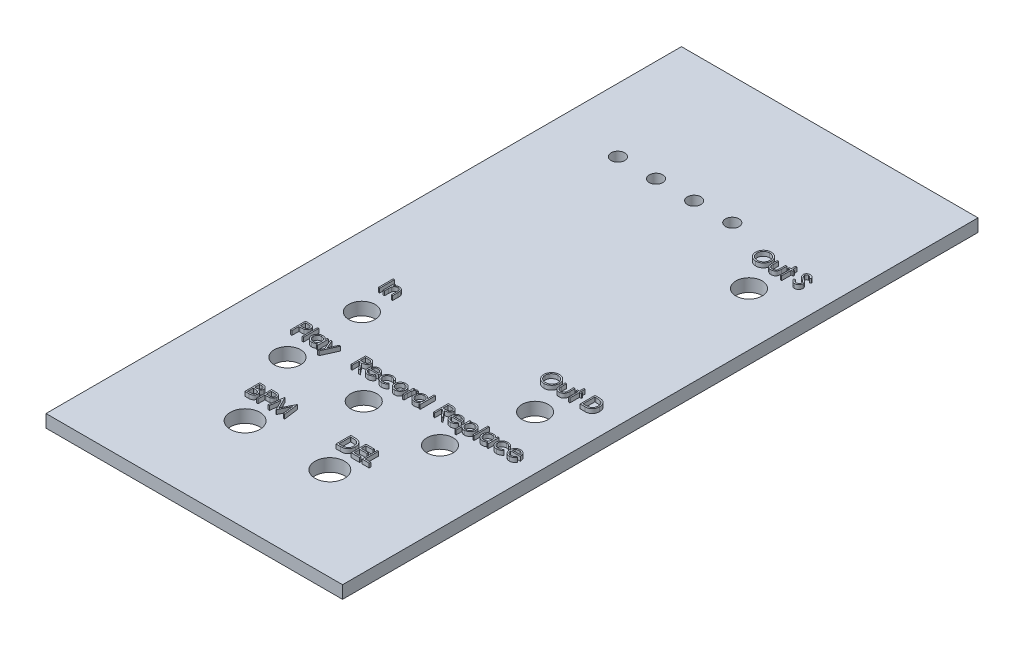
from build123d import *

# Parameters (mm, degrees)
SKETCH1_W           = 70
SKETCH1_H           = 150
SKETCH1_R           = 1.6
SKETCH1_R_2         = 3.1
SKETCH1_R_3         = 3.5
BOSS_EXTRUDE1_DEPTH = 3
SKETCH2_W           = 0.314102564
SKETCH2_H           = 3.5
SKETCH2_H_2         = 3.58974359
BOSS_EXTRUDE2_DEPTH = 1


with BuildPart() as part:
    # Sketch1 → Boss-Extrude1 (new body)
    with BuildSketch(Plane(origin=(0, 0, 0), x_dir=(1, 0, 0), z_dir=(0, 1, 0))):
        with Locations((35, -75)):
            Rectangle(SKETCH1_W, SKETCH1_H)
        with Locations(Location((15, -30, 0), (0, 0, 270))):
            Circle(SKETCH1_R, mode=Mode.SUBTRACT)
        with Locations(Location((24, -30, 0), (0, 0, 270))):
            Circle(SKETCH1_R, mode=Mode.SUBTRACT)
        with Locations(Location((33, -30, 0), (0, 0, 270))):
            Circle(SKETCH1_R, mode=Mode.SUBTRACT)
        with Locations(Location((42, -30, 0), (0, 0, 270))):
            Circle(SKETCH1_R, mode=Mode.SUBTRACT)
        with Locations(Location((16.52, -91.96, 0), (0, 0, 270))):
            Circle(SKETCH1_R_2, mode=Mode.SUBTRACT)
        with Locations(Location((57.41, -91.96, 0), (0, 0, 270))):
            Circle(SKETCH1_R_2, mode=Mode.SUBTRACT)
        with Locations(Location((57.41, -41.46, 0), (0, 0, 270))):
            Circle(SKETCH1_R_2, mode=Mode.SUBTRACT)
        with Locations(Location((17, -110, 0), (0, 0, 270))):
            Circle(SKETCH1_R_2, mode=Mode.SUBTRACT)
        with Locations(Location((35, -110, 0), (0, 0, 270))):
            Circle(SKETCH1_R_2, mode=Mode.SUBTRACT)
        with Locations(Location((53, -110, 0), (0, 0, 270))):
            Circle(SKETCH1_R_2, mode=Mode.SUBTRACT)
        with Locations(Location((25, -128, 0), (0, 0, 270))):
            Circle(SKETCH1_R_3, mode=Mode.SUBTRACT)
        with Locations(Location((45, -128, 0), (0, 0, 270))):
            Circle(SKETCH1_R_3, mode=Mode.SUBTRACT)
    extrude(amount=BOSS_EXTRUDE1_DEPTH)

    # Sketch2 → Boss-Extrude2 (add)
    # profile 1 of 33: a face of its own
    with BuildSketch(Plane(origin=(0, 3, 0), x_dir=(1, 0, 0), z_dir=(0, 1, 0))):
        with BuildLine():
            add(Edge.make_bspline(
                [(53.586538462, -32.41025641), (53.651346567, -32.41189789), (53.778635034, -32.415121891), (53.965709932, -32.439800994), (54.144305027, -32.482496384), (54.315875166, -32.539359367), (54.478368143, -32.615213752), (54.633007035, -32.7068989), (54.779423909, -32.815375359), (54.915645291, -32.939804586), (55.040302241, -33.07518804), (55.150128127, -33.21966595), (55.242170421, -33.372364752), (55.317756208, -33.532825583), (55.377054818, -33.700685551), (55.417973861, -33.876839554), (55.444112012, -34.060146244), (55.447167789, -34.185173108), (55.448717949, -34.248597756)],
                knots=[0, 0, 0, 0, 1.065120563, 2.091984664, 3.0946048, 4.079830382, 5.057816894, 6.036188127, 7.030412546, 8.04752943, 9.064399622, 10.05169764, 11.02544977, 11.989514704, 12.962713494, 13.945757189, 14.957906945, 16, 16, 16, 16], degree=3))
            add(Edge.make_bspline(
                [(55.448717949, -34.248597756), (55.447168016, -34.311555203), (55.44411292, -34.435651623), (55.417944142, -34.617795067), (55.376903142, -34.792885764), (55.318306876, -34.960631417), (55.243081397, -35.12120898), (55.150426226, -35.274195934), (55.041285016, -35.419642433), (54.917078165, -35.555955098), (54.781677123, -35.680952569), (54.636446856, -35.789871444), (54.484653536, -35.883595569), (54.324343828, -35.958379243), (54.157643791, -36.018151163), (53.983061468, -36.058903793), (53.801414914, -36.085190837), (53.67754391, -36.088209353), (53.614583333, -36.08974359)],
                knots=[0, 0, 0, 0, 1.043624062, 2.057103931, 3.04512605, 4.022047818, 4.998200453, 5.980619268, 6.982898556, 8.009068085, 9.034988726, 10.034168286, 11.015286542, 11.987931943, 12.962482838, 13.94673481, 14.956375938, 16, 16, 16, 16], degree=3))
            add(Edge.make_bspline(
                [(53.614583333, -36.08974359), (53.551159014, -36.088194203), (53.426132798, -36.085139949), (53.242595763, -36.058958544), (53.066318019, -36.01801724), (52.897803668, -35.959507804), (52.736958738, -35.883890573), (52.583468656, -35.791686194), (52.437949508, -35.682279053), (52.301607762, -35.558112479), (52.176858564, -35.422940927), (52.068099188, -35.278106671), (51.975874075, -35.126451215), (51.900510742, -34.967553691), (51.840846283, -34.802182248), (51.800141465, -34.629233771), (51.773805513, -34.449694265), (51.770770666, -34.327451366), (51.769230769, -34.265424679)],
                knots=[0, 0, 0, 0, 1.053102029, 2.075944431, 3.073151272, 4.055350789, 5.033113405, 6.020478099, 7.024410459, 8.052272461, 9.079885166, 10.07527673, 11.055994387, 12.023226415, 12.992069828, 13.970394897, 14.97016774, 16, 16, 16, 16], degree=3))
            add(Edge.make_bspline(
                [(51.769230769, -34.265424679), (51.769765405, -34.22379201), (51.770827931, -34.141051887), (51.783619624, -34.018185287), (51.802181325, -33.897294629), (51.828783237, -33.778723681), (51.863574904, -33.662762696), (51.904626932, -33.548611933), (51.954766777, -33.43742821), (52.011447425, -33.328684818), (52.074709233, -33.224076912), (52.144584983, -33.125197329), (52.218620351, -33.031216332), (52.299783745, -32.944569328), (52.38540019, -32.862735672), (52.476858568, -32.786972955), (52.573600812, -32.716598004), (52.676043192, -32.653177663), (52.781661467, -32.595818528), (52.890538245, -32.546596677), (53.001194816, -32.504350616), (53.114149464, -32.470109791), (53.229102236, -32.443077755), (53.346304021, -32.424670401), (53.465661447, -32.411846083), (53.546072766, -32.410788581), (53.586538462, -32.41025641)],
                knots=[0, 0, 0, 0, 1.037015668, 2.060948919, 3.074880161, 4.083647147, 5.086022904, 6.090072063, 7.104153813, 8.122640571, 9.144368836, 10.147691507, 11.138137339, 12.123020368, 13.103399296, 14.087645067, 15.080126199, 16.082011238, 17.087798457, 18.072939717, 19.057185487, 20.037253025, 21.01195951, 21.997135196, 22.992090687, 24, 24, 24, 24], degree=3))
        make_face()
        with BuildLine():
            add(Edge.make_bspline(
                [(53.601963141, -32.769230769), (53.568748507, -32.769635659), (53.502636775, -32.770441569), (53.404352238, -32.781057285), (53.307360304, -32.796187174), (53.211640942, -32.817768695), (53.117594653, -32.847172747), (53.024344812, -32.881013655), (52.932741758, -32.922234746), (52.8430879, -32.96880745), (52.756172825, -33.020356371), (52.674160123, -33.077328138), (52.596837479, -33.138386693), (52.524394213, -33.20367453), (52.457043041, -33.273524132), (52.393458339, -33.346876568), (52.336188758, -33.425828459), (52.283703181, -33.508238866), (52.23673534, -33.594000447), (52.194969986, -33.682210309), (52.160805977, -33.773587996), (52.132943601, -33.867142154), (52.10984379, -33.962724613), (52.095209866, -34.061060462), (52.084477506, -34.161655574), (52.083717661, -34.229637428), (52.083333333, -34.264022436)],
                knots=[0, 0, 0, 0, 1.008559885, 2.007477868, 2.99961109, 3.989939068, 4.984837346, 5.991145699, 7.001802488, 8.033829008, 9.059044045, 10.069351652, 11.065060232, 12.050310815, 13.029377138, 14.011219647, 14.996725999, 15.989392538, 16.977580475, 17.965360261, 18.951710183, 19.937753436, 20.929683414, 21.935841486, 22.955955122, 24, 24, 24, 24], degree=3))
            add(Edge.make_bspline(
                [(52.083333333, -34.264022436), (52.084608195, -34.314584657), (52.087116243, -34.414056187), (52.109073813, -34.559824331), (52.142895788, -34.699912617), (52.192753154, -34.833554526), (52.255103769, -34.961898809), (52.332130659, -35.083806914), (52.423389745, -35.199311788), (52.527053271, -35.307607057), (52.640375978, -35.406452862), (52.760708708, -35.49321627), (52.886762315, -35.56662652), (53.018865518, -35.626431592), (53.156313057, -35.67382133), (53.299990608, -35.706299961), (53.448941068, -35.727675417), (53.550471723, -35.729728173), (53.601963141, -35.730769231)],
                knots=[0, 0, 0, 0, 1.032063989, 2.030389145, 3.003944642, 3.970395727, 4.937377036, 5.913328081, 6.909231446, 7.93887556, 8.970685674, 9.976071282, 10.964166581, 11.944589148, 12.933237628, 13.927779006, 14.949070134, 16, 16, 16, 16], degree=3))
            add(Edge.make_bspline(
                [(53.601963141, -35.730769231), (53.636572643, -35.730293726), (53.705213679, -35.729350658), (53.807309201, -35.719851982), (53.907565413, -35.704620112), (54.005841693, -35.682689457), (54.102026504, -35.65524225), (54.196521307, -35.622634522), (54.288319598, -35.581953318), (54.378579436, -35.537005367), (54.464975677, -35.485765209), (54.54745121, -35.43072706), (54.623927189, -35.369758439), (54.696316261, -35.305440626), (54.76394395, -35.236476779), (54.826352934, -35.162956557), (54.883333066, -35.0844159), (54.935798713, -35.002130494), (54.982601976, -34.916134241), (55.023381075, -34.827604563), (55.05797719, -34.736759454), (55.085905695, -34.643467882), (55.107791157, -34.547907034), (55.122871077, -34.449948955), (55.133419516, -34.349789613), (55.134214593, -34.282045757), (55.134615385, -34.247896635)],
                knots=[0, 0, 0, 0, 1.047197238, 2.076906641, 3.100256066, 4.114471768, 5.12198147, 6.126382909, 7.136867548, 8.15857795, 9.17633901, 10.174870724, 11.156907918, 12.133735059, 13.104061851, 14.077631395, 15.04955518, 16.038496417, 17.029181396, 18.010275684, 18.986308667, 19.968651475, 20.955262928, 21.950658345, 22.966943676, 24, 24, 24, 24], degree=3))
            add(Edge.make_bspline(
                [(55.134615385, -34.247896635), (55.134214272, -34.21398113), (55.13341859, -34.14670348), (55.122876116, -34.047242662), (55.107775225, -33.94998945), (55.086012517, -33.855325647), (55.057962363, -33.763227122), (55.023375033, -33.673780375), (54.982589734, -33.586652179), (54.935781509, -33.502057882), (54.883165686, -33.420883145), (54.825671442, -33.343280732), (54.762306094, -33.270707991), (54.694880069, -33.201373297), (54.621709184, -33.136755407), (54.54312489, -33.076832886), (54.460081212, -33.020159612), (54.372153977, -32.96903405), (54.281410023, -32.921819818), (54.188296065, -32.881368814), (54.093866965, -32.846996695), (53.998362853, -32.81767973), (53.900979875, -32.7962717), (53.802376046, -32.78104365), (53.702687787, -32.770445264), (53.635644568, -32.769636886), (53.601963141, -32.769230769)],
                knots=[0, 0, 0, 0, 1.02996197, 2.043119294, 3.035359645, 4.018872909, 4.991431989, 5.957985074, 6.929999688, 7.912076566, 8.892894881, 9.867085534, 10.843653904, 11.817741046, 12.803660682, 13.806313499, 14.818574707, 15.856120519, 16.894564902, 17.924820532, 18.937903209, 19.946497019, 20.957711757, 21.963978472, 22.977135795, 24, 24, 24, 24], degree=3))
        make_face(mode=Mode.SUBTRACT)
    # profile 2 of 33: a face of its own
    with BuildSketch(Plane(origin=(0, 3, 0), x_dir=(1, 0, 0), z_dir=(0, 1, 0))):
        with BuildLine():
            Line((56.032051282, -33.442307692), (56.346153846, -33.442307692))
            Line((56.346153846, -33.442307692), (56.346153846, -34.628605769))
            add(Edge.make_bspline(
                [(56.346153846, -34.628605769), (56.346295751, -34.663428518), (56.346567208, -34.730042806), (56.348408149, -34.825897993), (56.352738243, -34.913314706), (56.358152068, -34.992343443), (56.365114204, -35.062970834), (56.373397564, -35.124950191), (56.382655986, -35.178984375), (56.3917187, -35.211527731), (56.395933494, -35.22666266)],
                knots=[0, 0, 0, 0, 1.388932606, 2.656963016, 3.823490214, 4.879454478, 5.816252168, 6.653371382, 7.373723809, 8, 8, 8, 8], degree=3))
            add(Edge.make_bspline(
                [(56.395933494, -35.22666266), (56.402694949, -35.245685531), (56.41607729, -35.283335792), (56.440350773, -35.337724798), (56.47037911, -35.38810008), (56.503238938, -35.436404153), (56.541138345, -35.48120614), (56.583597817, -35.522430383), (56.629196054, -35.561634474), (56.696951077, -35.608019266), (56.789610343, -35.657734597), (56.911263098, -35.700630415), (57.043167324, -35.726266235), (57.134332043, -35.72924049), (57.181189904, -35.730769231)],
                knots=[0, 0, 0, 0, 0.725840625, 1.436591201, 2.137033971, 2.831655856, 3.53531722, 4.242432219, 4.957935707, 5.694543706, 7.190802206, 8.724350549, 10.316345118, 12, 12, 12, 12], degree=3))
            add(Edge.make_bspline(
                [(57.181189904, -35.730769231), (57.228043412, -35.729207982), (57.31869628, -35.726187255), (57.449151249, -35.701403716), (57.568402664, -35.659998027), (57.675253615, -35.602190616), (57.769219455, -35.531448553), (57.847523874, -35.448439744), (57.912131128, -35.355790357), (57.940340549, -35.286666078), (57.954527244, -35.251903045)],
                knots=[0, 0, 0, 0, 1.157059328, 2.238695713, 3.266970494, 4.264342957, 5.228770407, 6.160125903, 7.074715775, 8, 8, 8, 8], degree=3))
            add(Edge.make_bspline(
                [(57.954527244, -35.251903045), (57.958721474, -35.237936746), (57.967993892, -35.207060671), (57.977956244, -35.154680922), (57.986930705, -35.092216318), (57.994593881, -35.019258109), (58.000059044, -34.935996957), (58.00300507, -34.842458881), (58.006333346, -34.73893752), (58.006383862, -34.666469761), (58.006410256, -34.628605769)],
                knots=[0, 0, 0, 0, 0.557542046, 1.232589297, 2.036731608, 2.971723315, 4.038036528, 5.22795436, 6.551621927, 8, 8, 8, 8], degree=3))
            Line((58.006410256, -34.628605769), (58.006410256, -33.442307692))
            Line((58.006410256, -33.442307692), (58.320512821, -33.442307692))
            Line((58.320512821, -33.442307692), (58.320512821, -34.6875))
            add(Edge.make_bspline(
                [(58.320512821, -34.6875), (58.320071126, -34.729807171), (58.319214177, -34.811888871), (58.313706834, -34.931172983), (58.304257221, -35.042335228), (58.289914536, -35.145434448), (58.273048862, -35.240391929), (58.251292589, -35.327329375), (58.225314351, -35.405978929), (58.196008836, -35.477720706), (58.161386968, -35.5427676), (58.124559948, -35.604503417), (58.082035176, -35.661396352), (58.037264942, -35.716278489), (57.987463286, -35.766420017), (57.933563427, -35.812971493), (57.876324007, -35.856644524), (57.814474809, -35.895735804), (57.748918746, -35.930952449), (57.679574889, -35.962168527), (57.605593891, -35.986871104), (57.527930254, -36.00818177), (57.446203475, -36.024896239), (57.360492342, -36.036682806), (57.270825725, -36.043908137), (57.209716266, -36.044545182), (57.178385417, -36.044871795)],
                knots=[0, 0, 0, 0, 1.493040784, 2.896703357, 4.213163133, 5.428574705, 6.569057535, 7.615249723, 8.588095153, 9.490268104, 10.346124644, 11.18633936, 12.024365274, 12.850166724, 13.684164916, 14.514361689, 15.362232829, 16.222528818, 17.093394965, 17.986930858, 18.902426812, 19.842810585, 20.827885679, 21.843828298, 22.894529745, 24, 24, 24, 24], degree=3))
            add(Edge.make_bspline(
                [(57.178385417, -36.044871795), (57.147288903, -36.044532088), (57.086181357, -36.043864532), (56.996510113, -36.036722724), (56.910561507, -36.024914553), (56.828641108, -36.008059336), (56.750666711, -35.987020266), (56.676322471, -35.96201673), (56.606478908, -35.930936249), (56.540296904, -35.895958691), (56.478294516, -35.856393416), (56.420185938, -35.813025376), (56.366049085, -35.765919313), (56.315872017, -35.715271956), (56.270359041, -35.66045502), (56.228942999, -35.601909459), (56.190986294, -35.540215371), (56.156633504, -35.474152208), (56.127121748, -35.401580198), (56.101066502, -35.321283101), (56.079755864, -35.232380585), (56.062413395, -35.134948656), (56.048461955, -35.029453615), (56.038775813, -34.915285199), (56.033359982, -34.792721507), (56.03249692, -34.708071617), (56.032051282, -34.664362981)],
                knots=[0, 0, 0, 0, 1.083640291, 2.129454052, 3.13281866, 4.105697902, 5.042300162, 5.946461698, 6.836384745, 7.703652036, 8.553297018, 9.397182691, 10.228592656, 11.052265423, 11.879314572, 12.708807002, 13.549817954, 14.402308542, 15.300838682, 16.27712199, 17.341985831, 18.484375296, 19.725102775, 21.0496083, 22.476576903, 24, 24, 24, 24], degree=3))
            Line((56.032051282, -34.664362981), (56.032051282, -33.442307692))
        make_face()
    # profile 3 of 33: a face of its own
    with BuildSketch(Plane(origin=(0, 3, 0), x_dir=(1, 0, 0), z_dir=(0, 1, 0))):
        Polygon((59.352564103, -32.41025641), (59.666666667, -32.41025641), (59.666666667, -33.442307692), (60.115384615, -33.442307692), (60.115384615, -33.756410256), (59.666666667, -33.756410256), (59.666666667, -36), (59.352564103, -36), (59.352564103, -33.756410256), (58.903846154, -33.756410256), (58.903846154, -33.442307692), (59.352564103, -33.442307692), align=None)
    # profile 4 of 33: a face of its own
    with BuildSketch(Plane(origin=(0, 3, 0), x_dir=(1, 0, 0), z_dir=(0, 1, 0))):
        with BuildLine():
            Line((61.730769231, -35.324819712), (62.026642628, -35.147435897))
            add(Edge.make_bspline(
                [(62.026642628, -35.147435897), (62.054160865, -35.193500282), (62.106884746, -35.281757866), (62.194836105, -35.401015907), (62.285969016, -35.502378063), (62.38095835, -35.585254671), (62.479224298, -35.650503558), (62.581408352, -35.696705789), (62.687166163, -35.725521765), (62.759139984, -35.729021851), (62.795072115, -35.730769231)],
                knots=[0, 0, 0, 0, 1.272034388, 2.437168799, 3.508375237, 4.49857839, 5.41946034, 6.295179144, 7.148887113, 8, 8, 8, 8], degree=3))
            add(Edge.make_bspline(
                [(62.795072115, -35.730769231), (62.825758976, -35.729914558), (62.886595749, -35.728220168), (62.976157992, -35.711939366), (63.063139794, -35.686927237), (63.145748432, -35.651106306), (63.222844046, -35.60776782), (63.290450742, -35.555421642), (63.348896855, -35.496815437), (63.39670597, -35.431432782), (63.433386005, -35.361115633), (63.461578073, -35.288939682), (63.477223147, -35.213771114), (63.4795799, -35.163160651), (63.480769231, -35.137620192)],
                knots=[0, 0, 0, 0, 1.095163259, 2.171163733, 3.241058638, 4.321873601, 5.38011039, 6.391990106, 7.366004449, 8.327778327, 9.272591725, 10.192022065, 11.087607919, 12, 12, 12, 12], degree=3))
            add(Edge.make_bspline(
                [(63.480769231, -35.137620192), (63.47929492, -35.108479343), (63.476297862, -35.049240253), (63.450966382, -34.9618406), (63.411117135, -34.87534803), (63.374354491, -34.821846765), (63.355268429, -34.794070513)],
                knots=[0, 0, 0, 0, 0.938893495, 1.908633276, 2.914225137, 4, 4, 4, 4], degree=3))
            add(Edge.make_bspline(
                [(63.355268429, -34.794070513), (63.339597815, -34.774023689), (63.306699321, -34.731937891), (63.250141808, -34.669292655), (63.183775694, -34.604674236), (63.109872139, -34.535615179), (63.02573905, -34.465327383), (62.934011536, -34.390459105), (62.832347677, -34.313857528), (62.76104818, -34.262484962), (62.724258814, -34.235977564)],
                knots=[0, 0, 0, 0, 0.722233717, 1.516239348, 2.393582979, 3.351407094, 4.387010283, 5.505090956, 6.712668013, 8, 8, 8, 8], degree=3))
            add(Edge.make_bspline(
                [(62.724258814, -34.235977564), (62.687434818, -34.209748976), (62.617030141, -34.159601914), (62.518571559, -34.08517763), (62.430527096, -34.017133761), (62.353288079, -33.954829749), (62.286888483, -33.898257144), (62.230805072, -33.847959205), (62.186466515, -33.802575644), (62.161810934, -33.773134302), (62.150741186, -33.759915865)],
                knots=[0, 0, 0, 0, 1.452282411, 2.77665338, 3.964542531, 5.026858415, 5.96415736, 6.766646006, 7.446254459, 8, 8, 8, 8], degree=3))
            add(Edge.make_bspline(
                [(62.150741186, -33.759915865), (62.135268641, -33.739314829), (62.104839804, -33.698800125), (62.064673798, -33.635475267), (62.030534636, -33.570652002), (62.003772304, -33.504156137), (61.981236085, -33.436921208), (61.966078154, -33.368069962), (61.956586757, -33.297911344), (61.955614771, -33.250697843), (61.955128205, -33.227063301)],
                knots=[0, 0, 0, 0, 1.068054152, 2.10047183, 3.106115577, 4.101338837, 5.06977816, 6.043150881, 7.020423561, 8, 8, 8, 8], degree=3))
            add(Edge.make_bspline(
                [(61.955128205, -33.227063301), (61.956433414, -33.190033527), (61.959015934, -33.116765463), (61.980856451, -33.009734633), (62.015329345, -32.907548215), (62.063624233, -32.811217882), (62.125881586, -32.723251901), (62.19792756, -32.642638414), (62.283739046, -32.574869832), (62.37789167, -32.515657773), (62.480948042, -32.469311848), (62.588938945, -32.434350868), (62.702036017, -32.41454161), (62.778639152, -32.411698845), (62.817508013, -32.41025641)],
                knots=[0, 0, 0, 0, 1.005424448, 1.989358655, 2.955360095, 3.929531133, 4.905563448, 5.876582895, 6.856512386, 7.866279853, 8.892233794, 9.918561126, 10.94386622, 12, 12, 12, 12], degree=3))
            add(Edge.make_bspline(
                [(62.817508013, -32.41025641), (62.858752113, -32.411678962), (62.940773465, -32.414507963), (63.06142268, -32.439105494), (63.177583397, -32.479806166), (63.271026662, -32.525994824), (63.344159423, -32.57212624), (63.399932156, -32.614146064), (63.456449607, -32.662521173), (63.514167661, -32.717380419), (63.572108321, -32.77922717), (63.631131773, -32.847637859), (63.691376042, -32.922194415), (63.730131902, -32.975418915), (63.75, -33.002704327)],
                knots=[0, 0, 0, 0, 1.286793592, 2.559021753, 3.825965368, 5.121522368, 5.803751409, 6.523245864, 7.299691795, 8.125521123, 9.008227632, 9.944561021, 10.946284179, 12, 12, 12, 12], degree=3))
            Line((63.75, -33.002704327), (63.466045673, -33.217948718))
            add(Edge.make_bspline(
                [(63.466045673, -33.217948718), (63.448899741, -33.195860028), (63.415880684, -33.153322374), (63.365751197, -33.093751059), (63.318502549, -33.039334579), (63.271952149, -32.992069451), (63.228558518, -32.949367318), (63.186441475, -32.912807561), (63.146207124, -32.882031966), (63.095490213, -32.849188406), (63.031772495, -32.816631902), (62.951787959, -32.789082824), (62.868201684, -32.772527762), (62.811272052, -32.770338874), (62.782451923, -32.769230769)],
                knots=[0, 0, 0, 0, 1.181633172, 2.275549214, 3.290209073, 4.226197932, 5.078386478, 5.862611352, 6.581680152, 7.217281963, 8.414376989, 9.595101626, 10.782541182, 12, 12, 12, 12], degree=3))
            add(Edge.make_bspline(
                [(62.782451923, -32.769230769), (62.746295401, -32.770442469), (62.676570953, -32.772779118), (62.577580717, -32.798299104), (62.488486792, -32.838480964), (62.411934227, -32.894795942), (62.34819725, -32.961516935), (62.302091791, -33.03829579), (62.274341627, -33.123078192), (62.270955347, -33.182219849), (62.269230769, -33.212339744)],
                knots=[0, 0, 0, 0, 1.14458467, 2.207223713, 3.21896685, 4.227309161, 5.202851033, 6.127160689, 7.046193047, 8, 8, 8, 8], degree=3))
            add(Edge.make_bspline(
                [(62.269230769, -33.212339744), (62.269623896, -33.231091222), (62.270410792, -33.268624842), (62.28138559, -33.324076264), (62.295484919, -33.379387603), (62.31782755, -33.434310186), (62.348672854, -33.489804545), (62.38917803, -33.546826282), (62.440191342, -33.605877991), (62.479268354, -33.644285365), (62.49989984, -33.664563301)],
                knots=[0, 0, 0, 0, 0.858281714, 1.717966888, 2.583508476, 3.4729293, 4.427298488, 5.488583878, 6.674047936, 8, 8, 8, 8], degree=3))
            add(Edge.make_bspline(
                [(62.49989984, -33.664563301), (62.507561212, -33.671400327), (62.525762879, -33.687643535), (62.559038805, -33.714235816), (62.602981603, -33.747038588), (62.656443804, -33.787625905), (62.720411166, -33.834707367), (62.794890722, -33.887680979), (62.879052255, -33.948266438), (62.938774171, -33.990623979), (62.970352564, -34.013020833)],
                knots=[0, 0, 0, 0, 0.420754252, 0.999615792, 1.744751191, 2.668019286, 3.750313428, 4.999500688, 6.413464383, 8, 8, 8, 8], degree=3))
            add(Edge.make_bspline(
                [(62.970352564, -34.013020833), (63.008338477, -34.040662193), (63.081892934, -34.094185855), (63.186550514, -34.174601535), (63.281444322, -34.253249303), (63.366907525, -34.32962691), (63.443784434, -34.403155003), (63.511222154, -34.474718184), (63.569907835, -34.543803756), (63.633087053, -34.632376332), (63.697644873, -34.741157416), (63.75308638, -34.874435655), (63.788044728, -35.008231975), (63.792616243, -35.098158812), (63.794871795, -35.142528045)],
                knots=[0, 0, 0, 0, 1.163667725, 2.253281268, 3.268753668, 4.215851969, 5.092017293, 5.902905408, 6.650798638, 7.335211899, 8.59617414, 9.77448103, 10.901945474, 12, 12, 12, 12], degree=3))
            add(Edge.make_bspline(
                [(63.794871795, -35.142528045), (63.794214657, -35.17390641), (63.792913142, -35.236053794), (63.777952228, -35.32730887), (63.756032563, -35.41593974), (63.722995329, -35.500850853), (63.682672171, -35.583595615), (63.631505923, -35.662003516), (63.572198238, -35.737809914), (63.504164473, -35.808993406), (63.429718571, -35.874339602), (63.351034876, -35.932468663), (63.267984603, -35.980936986), (63.181018286, -36.020487828), (63.09011595, -36.051421346), (62.995308166, -36.073834215), (62.896438655, -36.087589926), (62.829238173, -36.089017687), (62.795072115, -36.08974359)],
                knots=[0, 0, 0, 0, 0.983748083, 1.948392443, 2.894712957, 3.844097841, 4.80183111, 5.778335162, 6.776009319, 7.81870978, 8.863265674, 9.881300176, 10.883814829, 11.87499822, 12.874611388, 13.892143829, 14.928324115, 16, 16, 16, 16], degree=3))
            add(Edge.make_bspline(
                [(62.795072115, -36.08974359), (62.768636772, -36.089232408), (62.716099012, -36.088216483), (62.63838953, -36.079235202), (62.562249941, -36.066528099), (62.488635659, -36.046354029), (62.416598248, -36.021877052), (62.346451013, -35.991738719), (62.278159959, -35.955621518), (62.211342376, -35.914326493), (62.146168202, -35.866268748), (62.083248734, -35.810295252), (62.020519548, -35.747949747), (61.959832152, -35.677539184), (61.899959008, -35.600201101), (61.842080598, -35.515211917), (61.78499888, -35.423034564), (61.749183413, -35.358169478), (61.730769231, -35.324819712)],
                knots=[0, 0, 0, 0, 0.915332311, 1.819136955, 2.706846663, 3.586547465, 4.459518054, 5.340707479, 6.227863349, 7.133153174, 8.059268498, 9.028702269, 10.047606654, 11.120612155, 12.245963614, 13.433783089, 14.680604001, 16, 16, 16, 16], degree=3))
        make_face()
    # profile 5 of 33: a face of its own
    with BuildSketch(Plane(origin=(0, 3, 0), x_dir=(1, 0, 0), z_dir=(0, 1, 0))):
        with Locations((14.605769231, -84.25)):
            Rectangle(SKETCH2_W, SKETCH2_H)
    # profile 6 of 33: a face of its own
    with BuildSketch(Plane(origin=(0, 3, 0), x_dir=(1, 0, 0), z_dir=(0, 1, 0))):
        with BuildLine():
            Line((15.570512821, -83.442307692), (15.884615385, -83.442307692))
            Line((15.884615385, -83.442307692), (15.884615385, -83.903645833))
            add(Edge.make_bspline(
                [(15.884615385, -83.903645833), (15.91815302, -83.86180311), (15.983233971, -83.780605847), (16.091618304, -83.673885272), (16.206162204, -83.585940047), (16.326164208, -83.515836253), (16.451787218, -83.462989627), (16.582265488, -83.424823696), (16.718380194, -83.401938868), (16.810944631, -83.398948637), (16.857772436, -83.397435897)],
                knots=[0, 0, 0, 0, 1.12780773, 2.188550248, 3.19190651, 4.159438251, 5.104880172, 6.052711206, 7.014878035, 8, 8, 8, 8], degree=3))
            add(Edge.make_bspline(
                [(16.857772436, -83.397435897), (16.90510307, -83.399181093), (16.997740538, -83.402596861), (17.132618599, -83.429613552), (17.258591993, -83.475758808), (17.375211549, -83.538970878), (17.480338762, -83.617577351), (17.572663613, -83.709155133), (17.649026861, -83.814491216), (17.700224224, -83.912214373), (17.733949872, -83.998903167), (17.755182209, -84.073149917), (17.773213191, -84.155868068), (17.788844939, -84.246807657), (17.79942205, -84.346605847), (17.807764342, -84.454853539), (17.813743036, -84.57151567), (17.813980243, -84.652202297), (17.814102564, -84.693810096)],
                knots=[0, 0, 0, 0, 1.235846778, 2.418850247, 3.575807741, 4.728682307, 5.871620074, 6.994088408, 8.11269785, 9.256955736, 9.865816715, 10.540099792, 11.271859618, 12.076849838, 12.949306005, 13.892391288, 14.913166135, 16, 16, 16, 16], degree=3))
            Line((17.814102564, -84.693810096), (17.814102564, -86))
            Line((17.814102564, -86), (17.5, -86))
            Line((17.5, -86), (17.5, -84.796875))
            add(Edge.make_bspline(
                [(17.5, -84.796875), (17.499806792, -84.762052555), (17.499437218, -84.695443144), (17.498271571, -84.600074121), (17.495461765, -84.513587543), (17.491513452, -84.436190175), (17.485734421, -84.367956339), (17.47971179, -84.308747062), (17.472346813, -84.25863752), (17.4657839, -84.228472437), (17.462840545, -84.21494391)],
                knots=[0, 0, 0, 0, 1.430800155, 2.736877192, 3.918605307, 4.986035426, 5.920637409, 6.731861385, 7.431261377, 8, 8, 8, 8], degree=3))
            add(Edge.make_bspline(
                [(17.462840545, -84.21494391), (17.452215013, -84.175232725), (17.431764153, -84.098800981), (17.38123017, -83.995126628), (17.317415989, -83.90692844), (17.239518139, -83.834751719), (17.148289064, -83.778580882), (17.043981921, -83.739606927), (16.92760328, -83.715230658), (16.845748898, -83.712803526), (16.803084936, -83.711538462)],
                knots=[0, 0, 0, 0, 1.084156227, 2.086665306, 3.027808233, 3.945421172, 4.874247719, 5.839848303, 6.874090471, 8, 8, 8, 8], degree=3))
            add(Edge.make_bspline(
                [(16.803084936, -83.711538462), (16.777817252, -83.712014466), (16.727813159, -83.712956467), (16.653663187, -83.722407765), (16.581739014, -83.737866221), (16.511318805, -83.758734858), (16.443811011, -83.787397127), (16.37704672, -83.819926498), (16.313539956, -83.86047471), (16.251936559, -83.905665331), (16.194623751, -83.955744538), (16.141295413, -84.008589048), (16.093757393, -84.064864652), (16.050688717, -84.1236646), (16.013510454, -84.185796438), (15.981057366, -84.250660744), (15.953521671, -84.318342893), (15.939838979, -84.365317954), (15.932992788, -84.388822115)],
                knots=[0, 0, 0, 0, 1.023777757, 2.026029729, 3.023749952, 4.003683103, 4.997618607, 5.993177895, 7.010360494, 8.046726602, 9.087585522, 10.09234134, 11.086953743, 12.070360549, 13.043493632, 14.017870808, 15.008233677, 16, 16, 16, 16], degree=3))
            add(Edge.make_bspline(
                [(15.932992788, -84.388822115), (15.92905314, -84.406077318), (15.920476731, -84.443640993), (15.911213551, -84.505285412), (15.902805976, -84.576595387), (15.895769017, -84.657487704), (15.891463601, -84.748245579), (15.886769204, -84.848481417), (15.885060143, -84.958594906), (15.884767789, -85.035256598), (15.884615385, -85.075220353)],
                knots=[0, 0, 0, 0, 0.615963638, 1.340920617, 2.168419149, 3.115676021, 4.16674242, 5.331190069, 6.6087489, 8, 8, 8, 8], degree=3))
            Line((15.884615385, -85.075220353), (15.884615385, -86))
            Line((15.884615385, -86), (15.570512821, -86))
            Line((15.570512821, -86), (15.570512821, -83.442307692))
        make_face()
    # profile 7 of 33: a face of its own
    with BuildSketch(Plane(origin=(0, 3, 0), x_dir=(1, 0, 0), z_dir=(0, 1, 0))):
        with BuildLine():
            add(Edge.make_bspline(
                [(53.586538462, -82.41025641), (53.651346567, -82.41189789), (53.778635034, -82.415121891), (53.965709932, -82.439800994), (54.144305027, -82.482496384), (54.315875166, -82.539359367), (54.478368143, -82.615213752), (54.633007035, -82.7068989), (54.779423909, -82.815375359), (54.915645291, -82.939804586), (55.040302241, -83.07518804), (55.150128127, -83.21966595), (55.242170421, -83.372364752), (55.317756208, -83.532825583), (55.377054818, -83.700685551), (55.417973861, -83.876839554), (55.444112012, -84.060146244), (55.447167789, -84.185173108), (55.448717949, -84.248597756)],
                knots=[0, 0, 0, 0, 1.065120563, 2.091984664, 3.0946048, 4.079830382, 5.057816894, 6.036188127, 7.030412546, 8.04752943, 9.064399622, 10.05169764, 11.02544977, 11.989514704, 12.962713494, 13.945757189, 14.957906945, 16, 16, 16, 16], degree=3))
            add(Edge.make_bspline(
                [(55.448717949, -84.248597756), (55.447168016, -84.311555203), (55.44411292, -84.435651623), (55.417944142, -84.617795067), (55.376903142, -84.792885764), (55.318306876, -84.960631417), (55.243081397, -85.12120898), (55.150426226, -85.274195934), (55.041285016, -85.419642433), (54.917078165, -85.555955098), (54.781677123, -85.680952569), (54.636446856, -85.789871444), (54.484653536, -85.883595569), (54.324343828, -85.958379243), (54.157643791, -86.018151163), (53.983061468, -86.058903793), (53.801414914, -86.085190837), (53.67754391, -86.088209353), (53.614583333, -86.08974359)],
                knots=[0, 0, 0, 0, 1.043624062, 2.057103931, 3.04512605, 4.022047818, 4.998200453, 5.980619268, 6.982898556, 8.009068085, 9.034988726, 10.034168286, 11.015286542, 11.987931943, 12.962482838, 13.94673481, 14.956375938, 16, 16, 16, 16], degree=3))
            add(Edge.make_bspline(
                [(53.614583333, -86.08974359), (53.551159014, -86.088194203), (53.426132798, -86.085139949), (53.242595763, -86.058958544), (53.066318019, -86.01801724), (52.897803668, -85.959507804), (52.736958738, -85.883890573), (52.583468656, -85.791686194), (52.437949508, -85.682279053), (52.301607762, -85.558112479), (52.176858564, -85.422940927), (52.068099188, -85.278106671), (51.975874075, -85.126451215), (51.900510742, -84.967553691), (51.840846283, -84.802182248), (51.800141465, -84.629233771), (51.773805513, -84.449694265), (51.770770666, -84.327451366), (51.769230769, -84.265424679)],
                knots=[0, 0, 0, 0, 1.053102029, 2.075944431, 3.073151272, 4.055350789, 5.033113405, 6.020478099, 7.024410459, 8.052272461, 9.079885166, 10.07527673, 11.055994387, 12.023226415, 12.992069828, 13.970394897, 14.97016774, 16, 16, 16, 16], degree=3))
            add(Edge.make_bspline(
                [(51.769230769, -84.265424679), (51.769765405, -84.22379201), (51.770827931, -84.141051887), (51.783619624, -84.018185287), (51.802181325, -83.897294629), (51.828783237, -83.778723681), (51.863574904, -83.662762696), (51.904626932, -83.548611933), (51.954766777, -83.43742821), (52.011447425, -83.328684818), (52.074709233, -83.224076912), (52.144584983, -83.125197329), (52.218620351, -83.031216332), (52.299783745, -82.944569328), (52.38540019, -82.862735672), (52.476858568, -82.786972955), (52.573600812, -82.716598004), (52.676043192, -82.653177663), (52.781661467, -82.595818528), (52.890538245, -82.546596677), (53.001194816, -82.504350616), (53.114149464, -82.470109791), (53.229102236, -82.443077755), (53.346304021, -82.424670401), (53.465661447, -82.411846083), (53.546072766, -82.410788581), (53.586538462, -82.41025641)],
                knots=[0, 0, 0, 0, 1.037015668, 2.060948919, 3.074880161, 4.083647147, 5.086022904, 6.090072063, 7.104153813, 8.122640571, 9.144368836, 10.147691507, 11.138137339, 12.123020368, 13.103399296, 14.087645067, 15.080126199, 16.082011238, 17.087798457, 18.072939717, 19.057185487, 20.037253025, 21.01195951, 21.997135196, 22.992090687, 24, 24, 24, 24], degree=3))
        make_face()
        with BuildLine():
            add(Edge.make_bspline(
                [(53.601963141, -82.769230769), (53.568748507, -82.769635659), (53.502636775, -82.770441569), (53.404352238, -82.781057285), (53.307360304, -82.796187174), (53.211640942, -82.817768695), (53.117594653, -82.847172747), (53.024344812, -82.881013655), (52.932741758, -82.922234746), (52.8430879, -82.96880745), (52.756172825, -83.020356371), (52.674160123, -83.077328138), (52.596837479, -83.138386693), (52.524394213, -83.20367453), (52.457043041, -83.273524132), (52.393458339, -83.346876568), (52.336188758, -83.425828459), (52.283703181, -83.508238866), (52.23673534, -83.594000447), (52.194969986, -83.682210309), (52.160805977, -83.773587996), (52.132943601, -83.867142154), (52.10984379, -83.962724613), (52.095209866, -84.061060462), (52.084477506, -84.161655574), (52.083717661, -84.229637428), (52.083333333, -84.264022436)],
                knots=[0, 0, 0, 0, 1.008559885, 2.007477868, 2.99961109, 3.989939068, 4.984837346, 5.991145699, 7.001802488, 8.033829008, 9.059044045, 10.069351652, 11.065060232, 12.050310815, 13.029377138, 14.011219647, 14.996725999, 15.989392538, 16.977580475, 17.965360261, 18.951710183, 19.937753436, 20.929683414, 21.935841486, 22.955955122, 24, 24, 24, 24], degree=3))
            add(Edge.make_bspline(
                [(52.083333333, -84.264022436), (52.084608195, -84.314584657), (52.087116243, -84.414056187), (52.109073813, -84.559824331), (52.142895788, -84.699912617), (52.192753154, -84.833554526), (52.255103769, -84.961898809), (52.332130659, -85.083806914), (52.423389745, -85.199311788), (52.527053271, -85.307607057), (52.640375978, -85.406452862), (52.760708708, -85.49321627), (52.886762315, -85.56662652), (53.018865518, -85.626431592), (53.156313057, -85.67382133), (53.299990608, -85.706299961), (53.448941068, -85.727675417), (53.550471723, -85.729728173), (53.601963141, -85.730769231)],
                knots=[0, 0, 0, 0, 1.032063989, 2.030389145, 3.003944642, 3.970395727, 4.937377036, 5.913328081, 6.909231446, 7.93887556, 8.970685674, 9.976071282, 10.964166581, 11.944589148, 12.933237628, 13.927779006, 14.949070134, 16, 16, 16, 16], degree=3))
            add(Edge.make_bspline(
                [(53.601963141, -85.730769231), (53.636572643, -85.730293726), (53.705213679, -85.729350658), (53.807309201, -85.719851982), (53.907565413, -85.704620112), (54.005841693, -85.682689457), (54.102026504, -85.65524225), (54.196521307, -85.622634522), (54.288319598, -85.581953318), (54.378579436, -85.537005367), (54.464975677, -85.485765209), (54.54745121, -85.43072706), (54.623927189, -85.369758439), (54.696316261, -85.305440626), (54.76394395, -85.236476779), (54.826352934, -85.162956557), (54.883333066, -85.0844159), (54.935798713, -85.002130494), (54.982601976, -84.916134241), (55.023381075, -84.827604563), (55.05797719, -84.736759454), (55.085905695, -84.643467882), (55.107791157, -84.547907034), (55.122871077, -84.449948955), (55.133419516, -84.349789613), (55.134214593, -84.282045757), (55.134615385, -84.247896635)],
                knots=[0, 0, 0, 0, 1.047197238, 2.076906641, 3.100256066, 4.114471768, 5.12198147, 6.126382909, 7.136867548, 8.15857795, 9.17633901, 10.174870724, 11.156907918, 12.133735059, 13.104061851, 14.077631395, 15.04955518, 16.038496417, 17.029181396, 18.010275684, 18.986308667, 19.968651475, 20.955262928, 21.950658345, 22.966943676, 24, 24, 24, 24], degree=3))
            add(Edge.make_bspline(
                [(55.134615385, -84.247896635), (55.134214272, -84.21398113), (55.13341859, -84.14670348), (55.122876116, -84.047242662), (55.107775225, -83.94998945), (55.086012517, -83.855325647), (55.057962363, -83.763227122), (55.023375033, -83.673780375), (54.982589734, -83.586652179), (54.935781509, -83.502057882), (54.883165686, -83.420883145), (54.825671442, -83.343280732), (54.762306094, -83.270707991), (54.694880069, -83.201373297), (54.621709184, -83.136755407), (54.54312489, -83.076832886), (54.460081212, -83.020159612), (54.372153977, -82.96903405), (54.281410023, -82.921819818), (54.188296065, -82.881368814), (54.093866965, -82.846996695), (53.998362853, -82.81767973), (53.900979875, -82.7962717), (53.802376046, -82.78104365), (53.702687787, -82.770445264), (53.635644568, -82.769636886), (53.601963141, -82.769230769)],
                knots=[0, 0, 0, 0, 1.02996197, 2.043119294, 3.035359645, 4.018872909, 4.991431989, 5.957985074, 6.929999688, 7.912076566, 8.892894881, 9.867085534, 10.843653904, 11.817741046, 12.803660682, 13.806313499, 14.818574707, 15.856120519, 16.894564902, 17.924820532, 18.937903209, 19.946497019, 20.957711757, 21.963978472, 22.977135795, 24, 24, 24, 24], degree=3))
        make_face(mode=Mode.SUBTRACT)
    # profile 8 of 33: a face of its own
    with BuildSketch(Plane(origin=(0, 3, 0), x_dir=(1, 0, 0), z_dir=(0, 1, 0))):
        with BuildLine():
            Line((56.032051282, -83.442307692), (56.346153846, -83.442307692))
            Line((56.346153846, -83.442307692), (56.346153846, -84.628605769))
            add(Edge.make_bspline(
                [(56.346153846, -84.628605769), (56.346295751, -84.663428518), (56.346567208, -84.730042806), (56.348408149, -84.825897993), (56.352738243, -84.913314706), (56.358152068, -84.992343443), (56.365114204, -85.062970834), (56.373397564, -85.124950191), (56.382655986, -85.178984375), (56.3917187, -85.211527731), (56.395933494, -85.22666266)],
                knots=[0, 0, 0, 0, 1.388932606, 2.656963016, 3.823490214, 4.879454478, 5.816252168, 6.653371382, 7.373723809, 8, 8, 8, 8], degree=3))
            add(Edge.make_bspline(
                [(56.395933494, -85.22666266), (56.402694949, -85.245685531), (56.41607729, -85.283335792), (56.440350773, -85.337724798), (56.47037911, -85.38810008), (56.503238938, -85.436404153), (56.541138345, -85.48120614), (56.583597817, -85.522430383), (56.629196054, -85.561634474), (56.696951077, -85.608019266), (56.789610343, -85.657734597), (56.911263098, -85.700630415), (57.043167324, -85.726266235), (57.134332043, -85.72924049), (57.181189904, -85.730769231)],
                knots=[0, 0, 0, 0, 0.725840625, 1.436591201, 2.137033971, 2.831655856, 3.53531722, 4.242432219, 4.957935707, 5.694543706, 7.190802206, 8.724350549, 10.316345118, 12, 12, 12, 12], degree=3))
            add(Edge.make_bspline(
                [(57.181189904, -85.730769231), (57.228043412, -85.729207982), (57.31869628, -85.726187255), (57.449151249, -85.701403716), (57.568402664, -85.659998027), (57.675253615, -85.602190616), (57.769219455, -85.531448553), (57.847523874, -85.448439744), (57.912131128, -85.355790357), (57.940340549, -85.286666078), (57.954527244, -85.251903045)],
                knots=[0, 0, 0, 0, 1.157059328, 2.238695713, 3.266970494, 4.264342957, 5.228770407, 6.160125903, 7.074715775, 8, 8, 8, 8], degree=3))
            add(Edge.make_bspline(
                [(57.954527244, -85.251903045), (57.958721474, -85.237936746), (57.967993892, -85.207060671), (57.977956244, -85.154680922), (57.986930705, -85.092216318), (57.994593881, -85.019258109), (58.000059044, -84.935996957), (58.00300507, -84.842458881), (58.006333346, -84.73893752), (58.006383862, -84.666469761), (58.006410256, -84.628605769)],
                knots=[0, 0, 0, 0, 0.557542046, 1.232589297, 2.036731608, 2.971723315, 4.038036528, 5.22795436, 6.551621927, 8, 8, 8, 8], degree=3))
            Line((58.006410256, -84.628605769), (58.006410256, -83.442307692))
            Line((58.006410256, -83.442307692), (58.320512821, -83.442307692))
            Line((58.320512821, -83.442307692), (58.320512821, -84.6875))
            add(Edge.make_bspline(
                [(58.320512821, -84.6875), (58.320071126, -84.729807171), (58.319214177, -84.811888871), (58.313706834, -84.931172983), (58.304257221, -85.042335228), (58.289914536, -85.145434448), (58.273048862, -85.240391929), (58.251292589, -85.327329375), (58.225314351, -85.405978929), (58.196008836, -85.477720706), (58.161386968, -85.5427676), (58.124559948, -85.604503417), (58.082035176, -85.661396352), (58.037264942, -85.716278489), (57.987463286, -85.766420017), (57.933563427, -85.812971493), (57.876324007, -85.856644524), (57.814474809, -85.895735804), (57.748918746, -85.930952449), (57.679574889, -85.962168527), (57.605593891, -85.986871104), (57.527930254, -86.00818177), (57.446203475, -86.024896239), (57.360492342, -86.036682806), (57.270825725, -86.043908137), (57.209716266, -86.044545182), (57.178385417, -86.044871795)],
                knots=[0, 0, 0, 0, 1.493040784, 2.896703357, 4.213163133, 5.428574705, 6.569057535, 7.615249723, 8.588095153, 9.490268104, 10.346124644, 11.18633936, 12.024365274, 12.850166724, 13.684164916, 14.514361689, 15.362232829, 16.222528818, 17.093394965, 17.986930858, 18.902426812, 19.842810585, 20.827885679, 21.843828298, 22.894529745, 24, 24, 24, 24], degree=3))
            add(Edge.make_bspline(
                [(57.178385417, -86.044871795), (57.147288903, -86.044532088), (57.086181357, -86.043864532), (56.996510113, -86.036722724), (56.910561507, -86.024914553), (56.828641108, -86.008059336), (56.750666711, -85.987020266), (56.676322471, -85.96201673), (56.606478908, -85.930936249), (56.540296904, -85.895958691), (56.478294516, -85.856393416), (56.420185938, -85.813025376), (56.366049085, -85.765919313), (56.315872017, -85.715271956), (56.270359041, -85.66045502), (56.228942999, -85.601909459), (56.190986294, -85.540215371), (56.156633504, -85.474152208), (56.127121748, -85.401580198), (56.101066502, -85.321283101), (56.079755864, -85.232380585), (56.062413395, -85.134948656), (56.048461955, -85.029453615), (56.038775813, -84.915285199), (56.033359982, -84.792721507), (56.03249692, -84.708071617), (56.032051282, -84.664362981)],
                knots=[0, 0, 0, 0, 1.083640291, 2.129454052, 3.13281866, 4.105697902, 5.042300162, 5.946461698, 6.836384745, 7.703652036, 8.553297018, 9.397182691, 10.228592656, 11.052265423, 11.879314572, 12.708807002, 13.549817954, 14.402308542, 15.300838682, 16.27712199, 17.341985831, 18.484375296, 19.725102775, 21.0496083, 22.476576903, 24, 24, 24, 24], degree=3))
            Line((56.032051282, -84.664362981), (56.032051282, -83.442307692))
        make_face()
    # profile 9 of 33: a face of its own
    with BuildSketch(Plane(origin=(0, 3, 0), x_dir=(1, 0, 0), z_dir=(0, 1, 0))):
        Polygon((59.352564103, -82.41025641), (59.666666667, -82.41025641), (59.666666667, -83.442307692), (60.115384615, -83.442307692), (60.115384615, -83.756410256), (59.666666667, -83.756410256), (59.666666667, -86), (59.352564103, -86), (59.352564103, -83.756410256), (58.903846154, -83.756410256), (58.903846154, -83.442307692), (59.352564103, -83.442307692), align=None)
    # profile 10 of 33: a face of its own
    with BuildSketch(Plane(origin=(0, 3, 0), x_dir=(1, 0, 0), z_dir=(0, 1, 0))):
        with BuildLine():
            Line((62.08974359, -86), (62.08974359, -82.5))
            Line((62.08974359, -82.5), (62.796474359, -82.5))
            add(Edge.make_bspline(
                [(62.796474359, -82.5), (62.857943347, -82.50044257), (62.976701112, -82.501297613), (63.14831356, -82.506719004), (63.307097322, -82.51630947), (63.452530181, -82.530278996), (63.585011393, -82.54743203), (63.704170002, -82.568932434), (63.810622144, -82.594320604), (63.876091585, -82.615966055), (63.907051282, -82.626201923)],
                knots=[0, 0, 0, 0, 1.314313732, 2.53924729, 3.670748893, 4.714932338, 5.66265055, 6.526160246, 7.303039223, 8, 8, 8, 8], degree=3))
            add(Edge.make_bspline(
                [(63.907051282, -82.626201923), (63.947546021, -82.641632629), (64.027617214, -82.672144123), (64.141624336, -82.729700424), (64.248949699, -82.794913526), (64.350168844, -82.867869389), (64.44296967, -82.950633737), (64.530977567, -83.039690823), (64.610592291, -83.138279163), (64.683500587, -83.244354151), (64.749236246, -83.356666203), (64.806375404, -83.475001312), (64.853829398, -83.59875852), (64.893222624, -83.727593668), (64.924269082, -83.861790046), (64.945451014, -84.001503912), (64.959422003, -84.146183101), (64.960826055, -84.244357565), (64.961538462, -84.294170673)],
                knots=[0, 0, 0, 0, 0.984719456, 1.947108742, 2.898477687, 3.838006223, 4.779231079, 5.722358779, 6.681677486, 7.655904652, 8.64651281, 9.637519902, 10.640069247, 11.656948941, 12.698408672, 13.768548281, 14.867775369, 16, 16, 16, 16], degree=3))
            add(Edge.make_bspline(
                [(64.961538462, -84.294170673), (64.960909494, -84.337431912), (64.959670048, -84.422682701), (64.948540732, -84.548323596), (64.932364412, -84.670237167), (64.907320214, -84.787842868), (64.876917701, -84.902171085), (64.837953549, -85.01200333), (64.793318053, -85.118347139), (64.741268175, -85.219764615), (64.68412679, -85.315847987), (64.622805047, -85.406423515), (64.557368351, -85.490198737), (64.487192718, -85.567427349), (64.413185002, -85.637992928), (64.334860671, -85.702484943), (64.25201762, -85.759641498), (64.165026898, -85.811708606), (64.071350768, -85.857128962), (63.969214902, -85.895558971), (63.858183724, -85.927405587), (63.738529767, -85.953976483), (63.61004629, -85.975053785), (63.472607324, -85.989180178), (63.326424034, -85.99873311), (63.226044769, -85.999569504), (63.174379006, -86)],
                knots=[0, 0, 0, 0, 1.105936401, 2.179363191, 3.223086493, 4.248585256, 5.251745608, 6.245858792, 7.225916811, 8.198733463, 9.158002045, 10.082870192, 10.993790845, 11.873723703, 12.748670949, 13.606408763, 14.465103618, 15.319838547, 16.196477973, 17.123216899, 18.106603292, 19.147568657, 20.255746949, 21.433717677, 22.679120308, 24, 24, 24, 24], degree=3))
            Line((63.174379006, -86), (62.08974359, -86))
        make_face()
        with BuildLine():
            Line((62.403846154, -85.641025641), (62.805588942, -85.641025641))
            add(Edge.make_bspline(
                [(62.805588942, -85.641025641), (62.863317313, -85.640777545), (62.974350111, -85.640300364), (63.134008109, -85.636113161), (63.279887505, -85.629271224), (63.412009015, -85.619696146), (63.530298039, -85.607027531), (63.635001789, -85.592902628), (63.725777047, -85.575305177), (63.780706484, -85.559354218), (63.806089744, -85.551983173)],
                knots=[0, 0, 0, 0, 1.375205317, 2.645023457, 3.804390687, 4.853969522, 5.800190428, 6.637939096, 7.370582563, 8, 8, 8, 8], degree=3))
            add(Edge.make_bspline(
                [(63.806089744, -85.551983173), (63.838038106, -85.540731615), (63.901171744, -85.518497242), (63.992052829, -85.47793958), (64.076809834, -85.429897511), (64.156919859, -85.376495237), (64.231246514, -85.315849235), (64.300670631, -85.249278246), (64.365052432, -85.176443471), (64.42372674, -85.097435309), (64.476235044, -85.012745514), (64.521706274, -84.92320668), (64.561557805, -84.82979987), (64.592836398, -84.731090711), (64.617351982, -84.627961653), (64.63471667, -84.520405439), (64.645531394, -84.408442157), (64.646792842, -84.332290033), (64.647435897, -84.293469551)],
                knots=[0, 0, 0, 0, 0.998632004, 1.973411704, 2.929992603, 3.868527914, 4.809262121, 5.754881198, 6.702106254, 7.672490631, 8.653608572, 9.636854334, 10.631411391, 11.644891563, 12.686317036, 13.754757253, 14.855430412, 16, 16, 16, 16], degree=3))
            add(Edge.make_bspline(
                [(64.647435897, -84.293469551), (64.64692261, -84.252536071), (64.645914253, -84.172121887), (64.633239942, -84.054131191), (64.614718387, -83.940650541), (64.587934701, -83.831672345), (64.553803822, -83.726983993), (64.51120918, -83.627164483), (64.462542561, -83.531159614), (64.404639224, -83.441185248), (64.34122363, -83.356092139), (64.270845751, -83.278137224), (64.194623713, -83.207142923), (64.113388863, -83.142003611), (64.024851764, -83.085339935), (63.931098073, -83.034653254), (63.830752402, -82.991637362), (63.760939706, -82.9687585), (63.725460737, -82.95713141)],
                knots=[0, 0, 0, 0, 1.122418816, 2.205001699, 3.251619955, 4.274784885, 5.280384055, 6.268708349, 7.249350384, 8.229342522, 9.199999885, 10.157847722, 11.105861043, 12.055065948, 13.010012805, 13.98527497, 14.976112212, 16, 16, 16, 16], degree=3))
            add(Edge.make_bspline(
                [(63.725460737, -82.95713141), (63.696109591, -82.949014982), (63.633701001, -82.93175723), (63.531861537, -82.912931857), (63.417246387, -82.896327358), (63.289346686, -82.882269319), (63.148308227, -82.872181998), (62.994022539, -82.864610683), (62.826422934, -82.859504051), (62.7102404, -82.859155343), (62.649939904, -82.858974359)],
                knots=[0, 0, 0, 0, 0.674548936, 1.434276114, 2.292660221, 3.240891867, 4.284742987, 5.42552168, 6.663806718, 8, 8, 8, 8], degree=3))
            Line((62.649939904, -82.858974359), (62.403846154, -82.858974359))
            Line((62.403846154, -82.858974359), (62.403846154, -85.641025641))
        make_face(mode=Mode.SUBTRACT)
    # profile 11 of 33: a face of its own
    with BuildSketch(Plane(origin=(0, 3, 0), x_dir=(1, 0, 0), z_dir=(0, 1, 0))):
        with BuildLine():
            Line((12.748717949, -101.5), (13.435116186, -101.5))
            add(Edge.make_bspline(
                [(13.435116186, -101.5), (13.482327092, -101.500051896), (13.572785285, -101.500151332), (13.702500341, -101.503166078), (13.820310072, -101.50719277), (13.925960453, -101.512774663), (14.019776551, -101.519371253), (14.101333851, -101.528623292), (14.171273407, -101.538283588), (14.213179857, -101.548104995), (14.232291667, -101.552584135)],
                knots=[0, 0, 0, 0, 1.415646017, 2.712440637, 3.8905458, 4.950247383, 5.884950622, 6.709939814, 7.411656543, 8, 8, 8, 8], degree=3))
            add(Edge.make_bspline(
                [(14.232291667, -101.552584135), (14.2564852, -101.559206084), (14.304302178, -101.572293946), (14.373203221, -101.59850767), (14.438757066, -101.629589835), (14.501188625, -101.665013775), (14.559730708, -101.706299339), (14.615256749, -101.751772957), (14.667276729, -101.802484525), (14.715498121, -101.857865265), (14.759782918, -101.916985475), (14.797912601, -101.980727705), (14.829839828, -102.048019008), (14.8572231, -102.118812579), (14.876931554, -102.193702903), (14.891778454, -102.272169615), (14.901202082, -102.354204305), (14.902104643, -102.410264173), (14.902564103, -102.438802083)],
                knots=[0, 0, 0, 0, 0.999701418, 1.975846123, 2.934577507, 3.890451536, 4.834027766, 5.787354733, 6.749476667, 7.726910423, 8.712836071, 9.690891519, 10.682875813, 11.679750201, 12.712814741, 13.765529915, 14.8625177, 16, 16, 16, 16], degree=3))
            add(Edge.make_bspline(
                [(14.902564103, -102.438802083), (14.902142678, -102.46757986), (14.901318132, -102.523885524), (14.891421847, -102.606258312), (14.878091655, -102.684976702), (14.857594603, -102.759866153), (14.83074893, -102.830481923), (14.799256877, -102.897903155), (14.761273346, -102.960982827), (14.717628517, -103.019949945), (14.669076922, -103.074859857), (14.615823984, -103.125314652), (14.558084692, -103.17101899), (14.496042543, -103.212075334), (14.429092695, -103.247531613), (14.358250541, -103.279288918), (14.282900325, -103.305959979), (14.230757811, -103.31999004), (14.204246795, -103.327123397)],
                knots=[0, 0, 0, 0, 1.121902311, 2.195077645, 3.232258892, 4.234102512, 5.217864754, 6.176164875, 7.132989551, 8.084763148, 9.034132444, 9.988522005, 10.94243251, 11.903244335, 12.886203696, 13.894208494, 14.929344452, 16, 16, 16, 16], degree=3))
            add(Edge.make_bspline(
                [(14.204246795, -103.327123397), (14.182319461, -103.331786379), (14.134264434, -103.342005573), (14.055121711, -103.35341403), (13.962976325, -103.36315163), (13.857954045, -103.370452768), (13.740149141, -103.376703136), (13.609497883, -103.38167123), (13.465743806, -103.384401084), (13.365472562, -103.384541877), (13.313120994, -103.384615385)],
                knots=[0, 0, 0, 0, 0.601384939, 1.31797006, 2.144135048, 3.087295005, 4.142315834, 5.309527816, 6.595305764, 8, 8, 8, 8], degree=3))
            Line((13.313120994, -103.384615385), (13.062820513, -103.384615385))
            Line((13.062820513, -103.384615385), (13.062820513, -105))
            Line((13.062820513, -105), (12.748717949, -105))
            Line((12.748717949, -105), (12.748717949, -101.5))
        make_face()
        with BuildLine():
            Line((13.062820513, -101.858974359), (13.062820513, -103.025641026))
            Line((13.062820513, -103.025641026), (13.675600962, -103.033353365))
            add(Edge.make_bspline(
                [(13.675600962, -103.033353365), (13.705520887, -103.033368829), (13.763280687, -103.033398681), (13.846716911, -103.029413458), (13.924126198, -103.024812925), (13.995270773, -103.018077002), (14.060182708, -103.008555744), (14.118970237, -102.998944006), (14.171177519, -102.985038644), (14.232276721, -102.966315574), (14.300360069, -102.934382959), (14.374427617, -102.888033069), (14.437198204, -102.82895236), (14.4915165, -102.762524529), (14.534622378, -102.6886254), (14.566178371, -102.609556463), (14.584719528, -102.526128613), (14.587205722, -102.469040475), (14.588461538, -102.440204327)],
                knots=[0, 0, 0, 0, 1.160613943, 2.240541288, 3.23993089, 4.169200891, 5.011653406, 5.7853311, 6.478053781, 7.106038997, 8.262395093, 9.384106736, 10.481365981, 11.59014053, 12.70357646, 13.786202915, 14.881775077, 16, 16, 16, 16], degree=3))
            add(Edge.make_bspline(
                [(14.588461538, -102.440204327), (14.587198892, -102.412065813), (14.584688907, -102.356129931), (14.566033044, -102.274151171), (14.53468373, -102.195915466), (14.491227135, -102.122942381), (14.438486006, -102.056753577), (14.377186662, -101.99925645), (14.307473401, -101.953034747), (14.24262517, -101.923201466), (14.185023984, -101.90498619), (14.134992024, -101.89224135), (14.07850135, -101.882065743), (14.01553357, -101.873826241), (13.946576736, -101.866772779), (13.871038421, -101.861986802), (13.789204778, -101.859185346), (13.732394207, -101.859046391), (13.702944712, -101.858974359)],
                knots=[0, 0, 0, 0, 1.120700087, 2.227813068, 3.331159281, 4.466773991, 5.599788987, 6.693661531, 7.80175334, 8.91857717, 9.525282508, 10.207424825, 10.974604443, 11.810962634, 12.737642355, 13.736264703, 14.826523623, 16, 16, 16, 16], degree=3))
            Line((13.702944712, -101.858974359), (13.062820513, -101.858974359))
        make_face(mode=Mode.SUBTRACT)
    # profile 12 of 33: a face of its own
    with BuildSketch(Plane(origin=(0, 3, 0), x_dir=(1, 0, 0), z_dir=(0, 1, 0))):
        with Locations((15.642948718, -103.205128205)):
            Rectangle(SKETCH2_W, SKETCH2_H_2)
    # profile 13 of 33: a face of its own
    with BuildSketch(Plane(origin=(0, 3, 0), x_dir=(1, 0, 0), z_dir=(0, 1, 0))):
        with BuildLine():
            Line((19.120512821, -102.442307692), (19.120512821, -105))
            Line((19.120512821, -105), (18.806410256, -105))
            Line((18.806410256, -105), (18.806410256, -104.557592147))
            add(Edge.make_bspline(
                [(18.806410256, -104.557592147), (18.770991466, -104.597631741), (18.701871251, -104.675769512), (18.586430133, -104.777851685), (18.464061955, -104.862230007), (18.335360633, -104.930379922), (18.20044239, -104.981571979), (18.059606303, -105.017958138), (17.912794922, -105.041351973), (17.812542567, -105.043687995), (17.761738782, -105.044871795)],
                knots=[0, 0, 0, 0, 1.074387032, 2.096679803, 3.090159297, 4.057316773, 5.018401886, 5.985159533, 6.978961417, 8, 8, 8, 8], degree=3))
            add(Edge.make_bspline(
                [(17.761738782, -105.044871795), (17.716570828, -105.043645423), (17.627497623, -105.041226962), (17.496468546, -105.022464659), (17.370376297, -104.992334037), (17.249101724, -104.950433147), (17.133429579, -104.894852326), (17.022369482, -104.828311078), (16.91649679, -104.749070248), (16.817425251, -104.658482219), (16.726193251, -104.560087232), (16.646131978, -104.455141685), (16.579378898, -104.344099381), (16.523558817, -104.228366227), (16.480562473, -104.107051308), (16.450588839, -103.98057414), (16.431848392, -103.849084266), (16.429430931, -103.759544743), (16.428205128, -103.714142628)],
                knots=[0, 0, 0, 0, 1.033919861, 2.038935746, 3.024066025, 3.998881131, 4.97069526, 5.957263378, 6.95902576, 7.993208707, 9.027059324, 10.027763471, 11.009749337, 11.988697705, 12.965288445, 13.950418724, 14.960734635, 16, 16, 16, 16], degree=3))
            add(Edge.make_bspline(
                [(16.428205128, -103.714142628), (16.4294581, -103.669678925), (16.431935156, -103.581776581), (16.450388376, -103.452497883), (16.481419385, -103.327979623), (16.524967233, -103.208622679), (16.580809188, -103.094282629), (16.648737275, -102.984878604), (16.728756399, -102.880109207), (16.821008806, -102.78243798), (16.920943576, -102.692217366), (17.027852307, -102.61380832), (17.139075589, -102.546091471), (17.256338599, -102.492437995), (17.377905704, -102.449028891), (17.50485915, -102.418995922), (17.636670728, -102.401298601), (17.726161221, -102.398735837), (17.771554487, -102.397435897)],
                knots=[0, 0, 0, 0, 1.020392517, 2.01726096, 2.990465484, 3.961182959, 4.928053699, 5.906110375, 6.912531644, 7.948652711, 8.985773172, 9.998621852, 10.987621588, 11.969261332, 12.953316658, 13.946091881, 14.958173133, 16, 16, 16, 16], degree=3))
            add(Edge.make_bspline(
                [(17.771554487, -102.397435897), (17.823754346, -102.398873649), (17.926115806, -102.401693012), (18.075843815, -102.425155739), (18.217488293, -102.464794206), (18.352142645, -102.518711704), (18.479323332, -102.590360433), (18.597826316, -102.680740394), (18.708891799, -102.789281581), (18.773272091, -102.872652026), (18.806410256, -102.915564904)],
                knots=[0, 0, 0, 0, 1.038897134, 2.037228247, 3.008116434, 3.962042015, 4.918381754, 5.904844433, 6.921570401, 8, 8, 8, 8], degree=3))
            Line((18.806410256, -102.915564904), (18.806410256, -102.442307692))
            Line((18.806410256, -102.442307692), (19.120512821, -102.442307692))
        make_face()
        with BuildLine():
            add(Edge.make_bspline(
                [(17.775761218, -102.711538462), (17.72984688, -102.713172099), (17.63921928, -102.71639664), (17.506175278, -102.741570135), (17.378861864, -102.78345473), (17.25791579, -102.840736631), (17.145247573, -102.912765368), (17.044553902, -102.999886751), (16.955011201, -103.099723765), (16.879702937, -103.211825875), (16.81831244, -103.332003967), (16.775145408, -103.457628405), (16.74667616, -103.586433382), (16.74376764, -103.673796068), (16.742307692, -103.717648237)],
                knots=[0, 0, 0, 0, 1.031046209, 2.035121221, 3.029706178, 4.034933723, 5.034054252, 6.02443088, 7.017295772, 8.038157696, 9.050218397, 10.03989886, 11.016116709, 12, 12, 12, 12], degree=3))
            add(Edge.make_bspline(
                [(16.742307692, -103.717648237), (16.744172586, -103.761238344), (16.747895062, -103.8482477), (16.774645757, -103.977228277), (16.81952563, -104.102882319), (16.880767693, -104.224143313), (16.957454318, -104.336727413), (17.04634297, -104.438467536), (17.148293252, -104.525957124), (17.261220759, -104.599194697), (17.381828729, -104.658357218), (17.508662661, -104.699522858), (17.639338299, -104.726100638), (17.728190633, -104.729205115), (17.772956731, -104.730769231)],
                knots=[0, 0, 0, 0, 0.979072187, 1.954306742, 2.945804271, 3.96968567, 4.997920485, 5.998718438, 6.996577872, 8.005894225, 9.015743152, 10.005417472, 10.995077863, 12, 12, 12, 12], degree=3))
            add(Edge.make_bspline(
                [(17.772956731, -104.730769231), (17.818403234, -104.729109267), (17.90879182, -104.725807763), (18.042230528, -104.700526498), (18.171725491, -104.6587577), (18.295512719, -104.600858573), (18.41082885, -104.529101217), (18.514326728, -104.445094126), (18.601842696, -104.347390942), (18.676035306, -104.240014489), (18.734210723, -104.122302492), (18.776586782, -103.996968302), (18.801640687, -103.864007553), (18.804798417, -103.773143626), (18.806410256, -103.726762821)],
                knots=[0, 0, 0, 0, 1.01762866, 2.023962475, 3.030623092, 4.058876274, 5.077231937, 6.066672613, 7.034107872, 8.005628644, 8.981990164, 9.965428785, 10.961468474, 12, 12, 12, 12], degree=3))
            add(Edge.make_bspline(
                [(18.806410256, -103.726762821), (18.8054506, -103.69142499), (18.803561693, -103.621868957), (18.789131123, -103.519741439), (18.766176197, -103.422007713), (18.733830027, -103.328565024), (18.691338742, -103.239930009), (18.640090976, -103.155466248), (18.579185527, -103.075613037), (18.509602831, -103.001469966), (18.433437628, -102.933843504), (18.352843087, -102.873479263), (18.26686434, -102.82389049), (18.176947303, -102.782849219), (18.082935969, -102.750190069), (17.984065349, -102.728402375), (17.881386362, -102.713442054), (17.811340307, -102.712179673), (17.775761218, -102.711538462)],
                knots=[0, 0, 0, 0, 1.050140795, 2.067009409, 3.05949893, 4.030605086, 5.00011959, 5.97591094, 6.962425594, 7.979863591, 8.993523472, 9.986985069, 10.967611495, 11.937549037, 12.921786183, 13.919465291, 14.943216303, 16, 16, 16, 16], degree=3))
        make_face(mode=Mode.SUBTRACT)
    # profile 14 of 33: a face of its own
    with BuildSketch(Plane(origin=(0, 3, 0), x_dir=(1, 0, 0), z_dir=(0, 1, 0))):
        Polygon((19.569230769, -102.442307692), (19.907872596, -102.442307692), (20.773758013, -104.401241987), (21.652964744, -102.442307692), (21.992307692, -102.442307692), (20.421794872, -105.942307692), (20.082451923, -105.942307692), (20.603385417, -104.781951122), align=None)
    # profile 15 of 33: a face of its own
    with BuildSketch(Plane(origin=(0, 3, 0), x_dir=(1, 0, 0), z_dir=(0, 1, 0))):
        with BuildLine():
            Line((26.948717949, -101.5), (27.649138622, -101.5))
            add(Edge.make_bspline(
                [(27.649138622, -101.5), (27.69587975, -101.500155586), (27.785627895, -101.500454328), (27.914201165, -101.502120091), (28.031028262, -101.506894447), (28.136048101, -101.51100303), (28.229258756, -101.518494972), (28.310946047, -101.525655619), (28.380733745, -101.53502928), (28.422979596, -101.543734703), (28.442107372, -101.547676282)],
                knots=[0, 0, 0, 0, 1.410062039, 2.707475311, 3.878576406, 4.937260626, 5.877586885, 6.699081471, 7.410979367, 8, 8, 8, 8], degree=3))
            add(Edge.make_bspline(
                [(28.442107372, -101.547676282), (28.467713996, -101.554003047), (28.518380985, -101.566521611), (28.591331051, -101.592981212), (28.660845375, -101.623600837), (28.7266352, -101.659564557), (28.788370991, -101.701139337), (28.846689302, -101.747607459), (28.901854765, -101.798714665), (28.951636395, -101.855749506), (28.998575447, -101.915586016), (29.038164073, -101.980289773), (29.072290553, -102.0479513), (29.09946107, -102.119258718), (29.121339044, -102.19352049), (29.136765283, -102.271409287), (29.146016471, -102.352570262), (29.146958326, -102.40792817), (29.147435897, -102.435997596)],
                knots=[0, 0, 0, 0, 1.027469482, 2.033020251, 3.019912614, 3.986113645, 4.951240523, 5.91722682, 6.890402269, 7.87763091, 8.8651537, 9.85103654, 10.82876324, 11.815024772, 12.821070561, 13.842952187, 14.906261191, 16, 16, 16, 16], degree=3))
            add(Edge.make_bspline(
                [(29.147435897, -102.435997596), (29.145966899, -102.482632701), (29.143100504, -102.573629869), (29.1163754, -102.70569075), (29.07259888, -102.828880065), (29.012275591, -102.943042703), (28.935456115, -103.045953348), (28.843131324, -103.136343803), (28.735249713, -103.211983716), (28.634820397, -103.264436521), (28.546106197, -103.298029429), (28.473072884, -103.321665788), (28.393405907, -103.339927753), (28.307868572, -103.356287885), (28.216104917, -103.36863958), (28.118334877, -103.377686174), (28.014488726, -103.383340223), (27.943149656, -103.384182228), (27.906450321, -103.384615385)],
                knots=[0, 0, 0, 0, 1.260483769, 2.459530307, 3.627416485, 4.787058657, 5.939039949, 7.08810263, 8.267026773, 9.491475466, 10.141966685, 10.831826277, 11.566392101, 12.351337768, 13.187381173, 14.07005841, 15.007169909, 16, 16, 16, 16], degree=3))
            Line((27.906450321, -103.384615385), (29.192307692, -105))
            Line((29.192307692, -105), (28.803886218, -105))
            Line((28.803886218, -105), (27.518028846, -103.384615385))
            Line((27.518028846, -103.384615385), (27.262820513, -103.384615385))
            Line((27.262820513, -103.384615385), (27.262820513, -105))
            Line((27.262820513, -105), (26.948717949, -105))
            Line((26.948717949, -105), (26.948717949, -101.5))
        make_face()
        with BuildLine():
            Line((27.262820513, -101.858974359), (27.262820513, -103.025641026))
            Line((27.262820513, -103.025641026), (27.903645833, -103.030548878))
            add(Edge.make_bspline(
                [(27.903645833, -103.030548878), (27.933565872, -103.030562115), (27.991559429, -103.030587771), (28.075460094, -103.026593995), (28.153580206, -103.022050677), (28.225620958, -103.015101331), (28.291614533, -103.00614526), (28.351527947, -102.994942275), (28.405458998, -102.981890213), (28.468357537, -102.961688587), (28.538594068, -102.929682569), (28.614925528, -102.88311707), (28.679927866, -102.824547951), (28.734845728, -102.757574495), (28.77897516, -102.683938246), (28.810087214, -102.604521877), (28.829829656, -102.521330279), (28.832158202, -102.464152171), (28.833333333, -102.435296474)],
                knots=[0, 0, 0, 0, 1.146690395, 2.22261258, 3.21895312, 4.145990853, 4.996080663, 5.770904154, 6.481378293, 7.121626537, 8.300444488, 9.431385265, 10.535395872, 11.636531494, 12.74115979, 13.810798291, 14.895190096, 16, 16, 16, 16], degree=3))
            add(Edge.make_bspline(
                [(28.833333333, -102.435296474), (28.832131212, -102.407149901), (28.829749047, -102.351373662), (28.810300278, -102.269717752), (28.777410897, -102.192650802), (28.733088659, -102.120486317), (28.679089504, -102.054980581), (28.615771691, -101.998933428), (28.544866496, -101.952683963), (28.478595298, -101.923129582), (28.419361085, -101.905009729), (28.367931425, -101.892258565), (28.309819948, -101.882014096), (28.244744489, -101.873806036), (28.172982858, -101.866751091), (28.094172207, -101.861999313), (28.008835427, -101.859185449), (27.949688496, -101.85904636), (27.919070513, -101.858974359)],
                knots=[0, 0, 0, 0, 1.101028733, 2.181837193, 3.264309656, 4.369019818, 5.486613113, 6.575447106, 7.666700264, 8.788928104, 9.402425223, 10.0903467, 10.862060571, 11.710948788, 12.657782767, 13.684531032, 14.801375019, 16, 16, 16, 16], degree=3))
            Line((27.919070513, -101.858974359), (27.262820513, -101.858974359))
        make_face(mode=Mode.SUBTRACT)
    # profile 16 of 33: a face of its own
    with BuildSketch(Plane(origin=(0, 3, 0), x_dir=(1, 0, 0), z_dir=(0, 1, 0))):
        with BuildLine():
            Line((31.919671474, -104.192307692), (32.198717949, -104.338842147))
            add(Edge.make_bspline(
                [(32.198717949, -104.338842147), (32.176481353, -104.378285479), (32.133217745, -104.455026582), (32.058816997, -104.560458442), (31.980824925, -104.655306158), (31.895720957, -104.737035812), (31.806051278, -104.808287197), (31.711318623, -104.870625022), (31.611029805, -104.923743542), (31.50518008, -104.96849607), (31.392880529, -105.002905564), (31.273859013, -105.027209785), (31.147887517, -105.042233054), (31.061541337, -105.043978194), (31.017327724, -105.044871795)],
                knots=[0, 0, 0, 0, 1.120438281, 2.179929193, 3.190490725, 4.156257408, 5.095198341, 6.022838206, 6.959905092, 7.901321166, 8.864066838, 9.862729781, 10.905609505, 12, 12, 12, 12], degree=3))
            add(Edge.make_bspline(
                [(31.017327724, -105.044871795), (30.968185747, -105.04372462), (30.872323985, -105.041486813), (30.732784238, -105.022194348), (30.60140482, -104.99072199), (30.478193116, -104.946756448), (30.363450864, -104.889329124), (30.256950009, -104.819369642), (30.158130483, -104.737237388), (30.070106274, -104.642220944), (29.990862391, -104.540538987), (29.920936571, -104.434583102), (29.86247914, -104.324619878), (29.81492653, -104.211349354), (29.776521665, -104.09548546), (29.749754961, -103.975973993), (29.734325213, -103.853138408), (29.731960768, -103.770041073), (29.730769231, -103.728165064)],
                knots=[0, 0, 0, 0, 1.145258523, 2.234067595, 3.276747158, 4.290159414, 5.277019952, 6.260822364, 7.254936242, 8.264827045, 9.274100331, 10.257902744, 11.220704747, 12.172965371, 13.118907548, 14.062713208, 15.023725156, 16, 16, 16, 16], degree=3))
            add(Edge.make_bspline(
                [(29.730769231, -103.728165064), (29.731828372, -103.688870234), (29.73392745, -103.610993069), (29.747158238, -103.495727524), (29.770606531, -103.383699072), (29.802782855, -103.274814624), (29.844334101, -103.16925649), (29.89516632, -103.066960426), (29.955358698, -102.968035287), (30.001831372, -102.905632153), (30.025240385, -102.874198718)],
                knots=[0, 0, 0, 0, 1.024358464, 2.0301432, 3.019427413, 4.004406732, 4.986367066, 5.972626655, 6.978780325, 8, 8, 8, 8], degree=3))
            add(Edge.make_bspline(
                [(30.025240385, -102.874198718), (30.056948067, -102.836329848), (30.119359014, -102.761791697), (30.224915369, -102.663853372), (30.339215566, -102.581809596), (30.460827192, -102.51380246), (30.591163666, -102.462128813), (30.728472957, -102.423621231), (30.874318543, -102.40204322), (30.974023764, -102.398995386), (31.025040064, -102.397435897)],
                knots=[0, 0, 0, 0, 1.030682036, 2.02871468, 2.997146059, 3.962720338, 4.930598197, 5.918074684, 6.934738563, 8, 8, 8, 8], degree=3))
            add(Edge.make_bspline(
                [(31.025040064, -102.397435897), (31.077487669, -102.398789946), (31.180377915, -102.401446282), (31.330410036, -102.426072615), (31.472370753, -102.46512517), (31.606203257, -102.52027896), (31.731921118, -102.591438512), (31.848707168, -102.679580353), (31.95855868, -102.781998441), (32.022467259, -102.86076165), (32.054987981, -102.900841346)],
                knots=[0, 0, 0, 0, 1.056321875, 2.072262726, 3.055038591, 4.01806755, 4.982017516, 5.957941055, 6.960871419, 8, 8, 8, 8], degree=3))
            add(Edge.make_bspline(
                [(32.054987981, -102.900841346), (32.077114919, -102.931044928), (32.121221512, -102.991251046), (32.176468612, -103.089422203), (32.224426007, -103.192132798), (32.262758968, -103.301043095), (32.293798469, -103.414862675), (32.316255288, -103.53440522), (32.329424907, -103.659635131), (32.332013604, -103.744961686), (32.333333333, -103.788461538)],
                knots=[0, 0, 0, 0, 0.94817472, 1.890038105, 2.849395472, 3.817997239, 4.812318967, 5.836947057, 6.897266129, 8, 8, 8, 8], degree=3))
            Line((32.333333333, -103.788461538), (30.044871795, -103.788461538))
            add(Edge.make_bspline(
                [(30.044871795, -103.788461538), (30.046411401, -103.822162003), (30.049438975, -103.888432606), (30.063554118, -103.98540339), (30.085802892, -104.077776732), (30.117071955, -104.164859774), (30.1549388, -104.247789901), (30.201324517, -104.325951938), (30.256664071, -104.398989868), (30.31838977, -104.467557006), (30.387096866, -104.528617767), (30.459379613, -104.583269543), (30.536273178, -104.62907514), (30.617171261, -104.66625503), (30.701943046, -104.695361346), (30.790615242, -104.715229166), (30.883013358, -104.728536273), (30.945999092, -104.730015939), (30.978064904, -104.730769231)],
                knots=[0, 0, 0, 0, 1.094153842, 2.151609401, 3.174256925, 4.172055639, 5.149267565, 6.128595816, 7.11444997, 8.118368179, 9.117203808, 10.09244225, 11.054858984, 12.015122123, 12.976791628, 13.957293641, 14.960065497, 16, 16, 16, 16], degree=3))
            add(Edge.make_bspline(
                [(30.978064904, -104.730769231), (31.009416051, -104.730161174), (31.071622742, -104.728954673), (31.1642636, -104.717222762), (31.255403127, -104.698252487), (31.34466411, -104.672362496), (31.430234956, -104.640785644), (31.509480506, -104.602682787), (31.582360722, -104.56053304), (31.650477689, -104.512323365), (31.716548682, -104.453315178), (31.782091168, -104.379679457), (31.852367822, -104.292591929), (31.896357414, -104.227046263), (31.919671474, -104.192307692)],
                knots=[0, 0, 0, 0, 0.99110716, 1.966546729, 2.947904876, 3.932708344, 4.903319531, 5.828989031, 6.710028674, 7.56322171, 8.463672341, 9.504779593, 10.677557249, 12, 12, 12, 12], degree=3))
        make_face()
        with BuildLine():
            add(Edge.make_bspline(
                [(32.019230769, -103.474358974), (32.007734145, -103.432696101), (31.985606843, -103.35250848), (31.939370479, -103.24146759), (31.887298938, -103.142779689), (31.825677207, -103.057200056), (31.755858481, -102.981196543), (31.675213298, -102.914777957), (31.584777405, -102.855360506), (31.485018264, -102.805208007), (31.379376479, -102.762518148), (31.268770287, -102.733893032), (31.155912499, -102.71428349), (31.079578213, -102.712457382), (31.041165865, -102.711538462)],
                knots=[0, 0, 0, 0, 1.154881502, 2.222775134, 3.210006277, 4.132804581, 5.035138423, 5.962687519, 6.919655026, 7.923214229, 8.944639381, 9.960483929, 10.97369054, 12, 12, 12, 12], degree=3))
            add(Edge.make_bspline(
                [(31.041165865, -102.711538462), (31.009816427, -102.712150133), (30.947845178, -102.713359279), (30.85654411, -102.724829408), (30.768864411, -102.743789253), (30.684159123, -102.76975421), (30.603538255, -102.804362812), (30.525343487, -102.844946039), (30.45156309, -102.894487623), (30.405421795, -102.932246478), (30.382111378, -102.951322115)],
                knots=[0, 0, 0, 0, 1.04873581, 2.073130211, 3.073294108, 4.04793562, 5.032784715, 6.005352987, 6.992311501, 8, 8, 8, 8], degree=3))
            add(Edge.make_bspline(
                [(30.382111378, -102.951322115), (30.365418096, -102.966416431), (30.331634962, -102.996963647), (30.286494441, -103.049592854), (30.243273968, -103.106344416), (30.203940315, -103.16938954), (30.167862729, -103.238010319), (30.134102751, -103.311627955), (30.103716339, -103.390801085), (30.086620229, -103.445973524), (30.077824519, -103.474358974)],
                knots=[0, 0, 0, 0, 0.879870761, 1.780643979, 2.707998968, 3.669668524, 4.684282772, 5.740141944, 6.837334558, 8, 8, 8, 8], degree=3))
            Line((30.077824519, -103.474358974), (32.019230769, -103.474358974))
        make_face(mode=Mode.SUBTRACT)
    # profile 17 of 33: a face of its own
    with BuildSketch(Plane(origin=(0, 3, 0), x_dir=(1, 0, 0), z_dir=(0, 1, 0))):
        with BuildLine():
            Line((35.474358974, -102.996895032), (35.211438301, -103.16025641))
            add(Edge.make_bspline(
                [(35.211438301, -103.16025641), (35.182608436, -103.124428016), (35.125861741, -103.053905906), (35.027322504, -102.962895973), (34.92231109, -102.884728931), (34.809033042, -102.82102518), (34.687647242, -102.77180373), (34.558632391, -102.736973524), (34.422006886, -102.715269281), (34.328341687, -102.712802445), (34.280348558, -102.711538462)],
                knots=[0, 0, 0, 0, 1.026593902, 2.0206758, 2.988051866, 3.946915611, 4.916868779, 5.907761954, 6.927957743, 8, 8, 8, 8], degree=3))
            add(Edge.make_bspline(
                [(34.280348558, -102.711538462), (34.241989601, -102.712595304), (34.166442678, -102.714676726), (34.055536525, -102.727687219), (33.949894172, -102.751329227), (33.848853463, -102.782480184), (33.753133044, -102.824230474), (33.662482126, -102.87504023), (33.576096636, -102.93409027), (33.496479894, -103.002500816), (33.423650887, -103.076899484), (33.360551973, -103.156653179), (33.30561504, -103.23937307), (33.262509084, -103.327124812), (33.227233913, -103.417900866), (33.204027193, -103.513414721), (33.188562498, -103.612442729), (33.186793169, -103.679961069), (33.185897436, -103.714142628)],
                knots=[0, 0, 0, 0, 1.112346261, 2.190735716, 3.231507886, 4.247384806, 5.251966152, 6.253067467, 7.256802811, 8.280671706, 9.291813951, 10.270744147, 11.225547591, 12.165006084, 13.100104208, 14.043489273, 15.009504848, 16, 16, 16, 16], degree=3))
            add(Edge.make_bspline(
                [(33.185897436, -103.714142628), (33.187676688, -103.758911839), (33.191211219, -103.847847035), (33.218912678, -103.979125137), (33.264257086, -104.106048827), (33.326314936, -104.227716964), (33.404792071, -104.34031112), (33.496964634, -104.441294574), (33.602883717, -104.528710602), (33.721616048, -104.601183127), (33.850373792, -104.659444495), (33.987763896, -104.700951828), (34.132663677, -104.7260042), (34.231870424, -104.729160143), (34.282451923, -104.730769231)],
                knots=[0, 0, 0, 0, 0.966302908, 1.919585723, 2.883856336, 3.870342332, 4.860282998, 5.839159637, 6.814385684, 7.815993281, 8.834850808, 9.858348828, 10.908058873, 12, 12, 12, 12], degree=3))
            add(Edge.make_bspline(
                [(34.282451923, -104.730769231), (34.328807107, -104.729469734), (34.419907346, -104.726915877), (34.553074631, -104.705386913), (34.679854542, -104.67014328), (34.800242572, -104.62099563), (34.914018738, -104.557468114), (35.020447913, -104.479108943), (35.121647852, -104.388172343), (35.181144828, -104.317854371), (35.211438301, -104.282051282)],
                knots=[0, 0, 0, 0, 1.039848629, 2.043578496, 3.018386758, 3.987534228, 4.954977003, 5.934852016, 6.948509513, 8, 8, 8, 8], degree=3))
            Line((35.211438301, -104.282051282), (35.474358974, -104.454527244))
            add(Edge.make_bspline(
                [(35.474358974, -104.454527244), (35.458771272, -104.477417971), (35.427647605, -104.523123447), (35.37561998, -104.587567564), (35.319500148, -104.647889246), (35.259507051, -104.704007636), (35.196424041, -104.757265655), (35.128096132, -104.80511723), (35.05672652, -104.850252053), (34.981477363, -104.890864925), (34.903126665, -104.927371246), (34.821784675, -104.958762417), (34.737804862, -104.985732523), (34.651088486, -105.00716987), (34.561464588, -105.024280708), (34.469164953, -105.03563441), (34.374221372, -105.044109691), (34.31004922, -105.044615558), (34.277544071, -105.044871795)],
                knots=[0, 0, 0, 0, 0.954134338, 1.905101784, 2.851144739, 3.791306361, 4.734911809, 5.6936923, 6.663572882, 7.643865596, 8.638447847, 9.640600242, 10.646758161, 11.676244097, 12.717260333, 13.78922464, 14.880174919, 16, 16, 16, 16], degree=3))
            add(Edge.make_bspline(
                [(34.277544071, -105.044871795), (34.227933187, -105.043980515), (34.130695495, -105.0422336), (33.988372987, -105.023025125), (33.85235932, -104.994067509), (33.722700962, -104.952503775), (33.599377728, -104.898998999), (33.482504609, -104.833642085), (33.372468591, -104.755890295), (33.270357808, -104.667127525), (33.176576362, -104.570886885), (33.096050172, -104.467036967), (33.026204901, -104.359395919), (32.970117358, -104.245586393), (32.925470432, -104.12712102), (32.894965599, -104.00305078), (32.875235862, -103.874398526), (32.872952482, -103.786665644), (32.871794872, -103.7421875)],
                knots=[0, 0, 0, 0, 1.1129367, 2.181364009, 3.217532258, 4.231199276, 5.232079859, 6.230262199, 7.231623845, 8.250719726, 9.263571943, 10.242672461, 11.195837495, 12.138959767, 13.085126421, 14.0317438, 15.002148558, 16, 16, 16, 16], degree=3))
            add(Edge.make_bspline(
                [(32.871794872, -103.7421875), (32.872235888, -103.712009065), (32.873113142, -103.651979178), (32.88317507, -103.562884111), (32.896173542, -103.474975566), (32.91819928, -103.389367847), (32.943639911, -103.304762557), (32.976115443, -103.222179455), (33.014210838, -103.141234783), (33.057462785, -103.062137053), (33.10615153, -102.986187513), (33.160032764, -102.914433849), (33.2170771, -102.846014083), (33.279953212, -102.783290323), (33.345992866, -102.723754131), (33.417064441, -102.668996007), (33.492760293, -102.618855016), (33.571943616, -102.572404001), (33.654568327, -102.531044566), (33.740134997, -102.495411328), (33.828128027, -102.464958752), (33.918688171, -102.440849833), (34.011214344, -102.420632409), (34.106435682, -102.407914563), (34.203987904, -102.39892829), (34.270043927, -102.397937498), (34.303485577, -102.397435897)],
                knots=[0, 0, 0, 0, 0.990994727, 1.971252077, 2.943264845, 3.907940874, 4.872158414, 5.844625996, 6.82015047, 7.809835459, 8.804511986, 9.781214284, 10.756496977, 11.728388426, 12.696359165, 13.676225489, 14.672885716, 15.677705647, 16.690706858, 17.706033469, 18.721040654, 19.747369689, 20.783475414, 21.830280724, 22.901553713, 24, 24, 24, 24], degree=3))
            add(Edge.make_bspline(
                [(34.303485577, -102.397435897), (34.345365685, -102.398357788), (34.428916565, -102.400196963), (34.552857271, -102.415675615), (34.674972465, -102.439012031), (34.793119569, -102.473584861), (34.905866083, -102.515448517), (35.011401533, -102.562461231), (35.107241637, -102.617055835), (35.195169226, -102.676775949), (35.275348744, -102.744136855), (35.348603236, -102.819943812), (35.416434885, -102.903802291), (35.454891597, -102.965608022), (35.474358974, -102.996895032)],
                knots=[0, 0, 0, 0, 1.095225653, 2.184976855, 3.262915854, 4.344593502, 5.400796181, 6.407717688, 7.363229445, 8.282371371, 9.184954523, 10.097238608, 11.036792983, 12, 12, 12, 12], degree=3))
        make_face()
    # profile 18 of 33: a face of its own
    with BuildSketch(Plane(origin=(0, 3, 0), x_dir=(1, 0, 0), z_dir=(0, 1, 0))):
        with BuildLine():
            add(Edge.make_bspline(
                [(37.337940705, -102.397435897), (37.385931978, -102.398457789), (37.480031136, -102.400461467), (37.617839021, -102.421876433), (37.749384157, -102.454623797), (37.87517035, -102.499895359), (37.993586645, -102.56057731), (38.106357889, -102.632986601), (38.213174898, -102.718769195), (38.277197927, -102.785127263), (38.309695513, -102.818810096)],
                knots=[0, 0, 0, 0, 1.054011418, 2.066658804, 3.057071809, 4.030435133, 4.997543892, 5.974964718, 6.972108034, 8, 8, 8, 8], degree=3))
            add(Edge.make_bspline(
                [(38.309695513, -102.818810096), (38.337677467, -102.851024082), (38.393099847, -102.914828624), (38.464165566, -103.018284237), (38.525387126, -103.125424338), (38.574450087, -103.237671664), (38.613135111, -103.354046336), (38.640600807, -103.474948347), (38.656937742, -103.600110694), (38.659140709, -103.685114532), (38.66025641, -103.728165064)],
                knots=[0, 0, 0, 0, 1.025258237, 2.030674902, 3.01204498, 3.988269485, 4.97094183, 5.956517959, 6.965070386, 8, 8, 8, 8], degree=3))
            add(Edge.make_bspline(
                [(38.66025641, -103.728165064), (38.659275073, -103.771465122), (38.657335905, -103.857028055), (38.638992288, -103.983047421), (38.610461202, -104.105242244), (38.569629364, -104.223100937), (38.517271255, -104.336983765), (38.453380567, -104.446393314), (38.37750895, -104.551545447), (38.291504953, -104.651547286), (38.196453077, -104.7437135), (38.093336929, -104.82404177), (37.984182895, -104.892863294), (37.867539542, -104.94829971), (37.744472055, -104.99200941), (37.614714987, -105.022709427), (37.478469917, -105.04127111), (37.385442695, -105.043654684), (37.337940705, -105.044871795)],
                knots=[0, 0, 0, 0, 0.998656419, 1.973391657, 2.932242238, 3.890759089, 4.846373663, 5.82037756, 6.809684879, 7.83454468, 8.860553229, 9.859544525, 10.845671541, 11.83227036, 12.833544569, 13.85385346, 14.904124723, 16, 16, 16, 16], degree=3))
            add(Edge.make_bspline(
                [(37.337940705, -105.044871795), (37.290205986, -105.043650599), (37.196715126, -105.041258824), (37.059989144, -105.022781541), (36.929999525, -104.992023559), (36.806770927, -104.948156066), (36.68962608, -104.892861522), (36.579839583, -104.824249833), (36.476639667, -104.743689678), (36.381567683, -104.651553741), (36.295569077, -104.551543784), (36.219696069, -104.446393746), (36.155805743, -104.336983652), (36.103447539, -104.223100967), (36.062615726, -104.105242236), (36.034084633, -103.983047423), (36.015741019, -103.857028055), (36.01380185, -103.771465122), (36.012820513, -103.728165064)],
                knots=[0, 0, 0, 0, 1.099876186, 2.154163076, 3.173186993, 4.173200201, 5.163417411, 6.152872554, 7.150605724, 8.17532212, 9.198891216, 10.186952605, 11.159729845, 12.11414092, 13.071450619, 14.029093627, 15.002601286, 16, 16, 16, 16], degree=3))
            add(Edge.make_bspline(
                [(36.012820513, -103.728165064), (36.013943823, -103.685348518), (36.016167785, -103.600579116), (36.032488294, -103.475652055), (36.05984685, -103.354954666), (36.098578247, -103.23902919), (36.148093438, -103.127273754), (36.208454725, -103.019868923), (36.280245358, -102.916881123), (36.33544731, -102.853159043), (36.36338141, -102.820913462)],
                knots=[0, 0, 0, 0, 1.031353054, 2.041901799, 3.029428768, 4.008703097, 4.981709435, 5.96992636, 6.972712378, 8, 8, 8, 8], degree=3))
            add(Edge.make_bspline(
                [(36.36338141, -102.820913462), (36.395830001, -102.786938522), (36.459645865, -102.720120826), (36.566994593, -102.634588302), (36.679488414, -102.560672228), (36.79921334, -102.501196013), (36.924896198, -102.454357495), (37.057115441, -102.42179198), (37.195390956, -102.400538625), (37.289950577, -102.398480447), (37.337940705, -102.397435897)],
                knots=[0, 0, 0, 0, 1.027980169, 2.021703884, 2.998553061, 3.971491411, 4.943284454, 5.930300938, 6.949603206, 8, 8, 8, 8], degree=3))
        make_face()
        with BuildLine():
            add(Edge.make_bspline(
                [(37.336538462, -102.711538462), (37.30260085, -102.712503053), (37.235601722, -102.714407336), (37.136982137, -102.72889124), (37.042041983, -102.751838745), (36.950601139, -102.784442801), (36.862967966, -102.8265417), (36.779058564, -102.87825006), (36.698626124, -102.938883016), (36.623244061, -103.008345688), (36.554061749, -103.084224683), (36.493583772, -103.165073041), (36.442158666, -103.249579388), (36.399318507, -103.337831599), (36.367411319, -103.430724013), (36.344238296, -103.527204644), (36.329768056, -103.62747006), (36.327881677, -103.695631079), (36.326923077, -103.730268429)],
                knots=[0, 0, 0, 0, 1.021534396, 2.016698045, 2.994645724, 3.958388632, 4.93408049, 5.916473867, 6.921342795, 7.962252576, 8.998418191, 10.008913653, 10.997312074, 11.973003931, 12.956656626, 13.948281152, 14.957379055, 16, 16, 16, 16], degree=3))
            add(Edge.make_bspline(
                [(36.326923077, -103.730268429), (36.328529901, -103.775020457), (36.331719145, -103.863844862), (36.357654381, -103.994655985), (36.401040661, -104.120237837), (36.459627941, -104.239854223), (36.53303416, -104.350526501), (36.619521226, -104.449197985), (36.718160927, -104.534383797), (36.827777427, -104.605064642), (36.946131745, -104.661224398), (37.071388066, -104.701023374), (37.20202876, -104.726895066), (37.291309491, -104.729466541), (37.336538462, -104.730769231)],
                knots=[0, 0, 0, 0, 1.016792936, 2.018143844, 3.017858371, 4.030088057, 5.03801393, 6.028138512, 7.003788237, 7.991172063, 8.984598303, 9.972568034, 10.972917682, 12, 12, 12, 12], degree=3))
            add(Edge.make_bspline(
                [(37.336538462, -104.730769231), (37.38176483, -104.729458951), (37.471040426, -104.726872494), (37.601499603, -104.701153674), (37.726413575, -104.661050013), (37.844644963, -104.605127803), (37.954211566, -104.534115389), (38.053560687, -104.449679012), (38.139309299, -104.35026516), (38.212642903, -104.239707631), (38.272189646, -104.120423279), (38.315372848, -103.994632807), (38.341370434, -103.863850765), (38.344551263, -103.775022434), (38.346153846, -103.730268429)],
                knots=[0, 0, 0, 0, 1.02726834, 2.027799167, 3.010890988, 4.004497153, 4.992059811, 5.971914811, 6.958719428, 7.966827853, 8.981595046, 9.981490638, 10.983022906, 12, 12, 12, 12], degree=3))
            add(Edge.make_bspline(
                [(38.346153846, -103.730268429), (38.345195576, -103.695630872), (38.343309847, -103.627469446), (38.328834883, -103.527206993), (38.305679343, -103.430715396), (38.273707726, -103.337863393), (38.231053712, -103.249350888), (38.178636919, -103.165321161), (38.118405893, -103.083944615), (38.048388772, -103.008590974), (37.973085395, -102.938855938), (37.892620356, -102.878226548), (37.808835378, -102.826768953), (37.721456795, -102.784082712), (37.630004228, -102.752135372), (37.535197098, -102.728758741), (37.436998288, -102.714468544), (37.370239245, -102.712521402), (37.336538462, -102.711538462)],
                knots=[0, 0, 0, 0, 1.042956736, 2.052379634, 3.044323526, 4.02829302, 5.004299113, 5.996692471, 7.007513377, 8.048758398, 9.090003419, 10.095195979, 11.07790575, 12.047570684, 13.018257071, 13.989683339, 14.985167495, 16, 16, 16, 16], degree=3))
        make_face(mode=Mode.SUBTRACT)
    # profile 19 of 33: a face of its own
    with BuildSketch(Plane(origin=(0, 3, 0), x_dir=(1, 0, 0), z_dir=(0, 1, 0))):
        with BuildLine():
            Line((39.198717949, -102.442307692), (39.512820513, -102.442307692))
            Line((39.512820513, -102.442307692), (39.512820513, -102.818810096))
            add(Edge.make_bspline(
                [(39.512820513, -102.818810096), (39.536009272, -102.783754268), (39.580357593, -102.716710269), (39.654070522, -102.628040968), (39.729573853, -102.554625921), (39.80722904, -102.496122402), (39.88760714, -102.452309283), (39.968944092, -102.420216248), (40.052519562, -102.401238933), (40.108681486, -102.398705274), (40.13681891, -102.397435897)],
                knots=[0, 0, 0, 0, 1.2804753, 2.448899062, 3.506932113, 4.484331642, 5.4025378, 6.288909075, 7.142734305, 8, 8, 8, 8], degree=3))
            add(Edge.make_bspline(
                [(40.13681891, -102.397435897), (40.158645237, -102.398626424), (40.203554322, -102.40107601), (40.271536912, -102.418286835), (40.341580364, -102.445764857), (40.386722751, -102.47160508), (40.41025641, -102.485076122)],
                knots=[0, 0, 0, 0, 0.901110191, 1.854092781, 2.881294221, 4, 4, 4, 4], degree=3))
            Line((40.41025641, -102.485076122), (40.237780449, -102.757111378))
            add(Edge.make_bspline(
                [(40.237780449, -102.757111378), (40.222671428, -102.750371112), (40.193991613, -102.737576797), (40.152037047, -102.722434787), (40.11335571, -102.713518871), (40.088712152, -102.712168153), (40.077223558, -102.711538462)],
                knots=[0, 0, 0, 0, 1.180555205, 2.24091978, 3.179933427, 4, 4, 4, 4], degree=3))
            add(Edge.make_bspline(
                [(40.077223558, -102.711538462), (40.052017824, -102.713218499), (40.000605434, -102.716645288), (39.925120935, -102.743584096), (39.851873729, -102.787109336), (39.793702067, -102.835380448), (39.748659814, -102.881928245), (39.716519589, -102.922576648), (39.687036842, -102.968155279), (39.658866621, -103.017884963), (39.633200327, -103.072614809), (39.609245658, -103.131798023), (39.587586795, -103.195503151), (39.575236551, -103.239885672), (39.568910256, -103.262620192)],
                knots=[0, 0, 0, 0, 1.125678352, 2.296057538, 3.5422874, 4.923748041, 5.663163013, 6.437101912, 7.23742474, 8.08941207, 8.991984279, 9.93940061, 10.944477711, 12, 12, 12, 12], degree=3))
            add(Edge.make_bspline(
                [(39.568910256, -103.262620192), (39.564177863, -103.282897366), (39.553695971, -103.327809765), (39.543504434, -103.403158289), (39.533434916, -103.492181948), (39.526338297, -103.595128541), (39.519760255, -103.711740985), (39.516050173, -103.84219693), (39.512947032, -103.986630282), (39.512863965, -104.087604635), (39.512820513, -104.140424679)],
                knots=[0, 0, 0, 0, 0.566838948, 1.255505196, 2.06880316, 3.007127437, 4.065329342, 5.249902469, 6.561414163, 8, 8, 8, 8], degree=3))
            Line((39.512820513, -104.140424679), (39.512820513, -105))
            Line((39.512820513, -105), (39.198717949, -105))
            Line((39.198717949, -105), (39.198717949, -102.442307692))
        make_face()
    # profile 20 of 33: a face of its own
    with BuildSketch(Plane(origin=(0, 3, 0), x_dir=(1, 0, 0), z_dir=(0, 1, 0))):
        with BuildLine():
            Line((43.326923077, -101.41025641), (43.326923077, -105))
            Line((43.326923077, -105), (43.012820513, -105))
            Line((43.012820513, -105), (43.012820513, -104.557592147))
            add(Edge.make_bspline(
                [(43.012820513, -104.557592147), (42.977401722, -104.597631741), (42.908281507, -104.675769512), (42.792840389, -104.777851685), (42.670472211, -104.862230007), (42.54177089, -104.930379922), (42.406852647, -104.981571979), (42.266016559, -105.017958138), (42.119205178, -105.041351973), (42.018952824, -105.043687995), (41.968149038, -105.044871795)],
                knots=[0, 0, 0, 0, 1.074387032, 2.096679803, 3.090159297, 4.057316773, 5.018401886, 5.985159533, 6.978961417, 8, 8, 8, 8], degree=3))
            add(Edge.make_bspline(
                [(41.968149038, -105.044871795), (41.922981085, -105.043645423), (41.83390788, -105.041226962), (41.702878803, -105.022464659), (41.576786553, -104.992334037), (41.45551198, -104.950433147), (41.339839835, -104.894852326), (41.228779738, -104.828311078), (41.122907046, -104.749070248), (41.023835507, -104.658482219), (40.932603507, -104.560087232), (40.852542234, -104.455141685), (40.785789155, -104.344099381), (40.729969074, -104.228366227), (40.686972729, -104.107051308), (40.656999095, -103.98057414), (40.638258648, -103.849084266), (40.635841188, -103.759544743), (40.634615385, -103.714142628)],
                knots=[0, 0, 0, 0, 1.033919861, 2.038935746, 3.024066025, 3.998881131, 4.97069526, 5.957263378, 6.95902576, 7.993208707, 9.027059324, 10.027763471, 11.009749337, 11.988697705, 12.965288445, 13.950418724, 14.960734635, 16, 16, 16, 16], degree=3))
            add(Edge.make_bspline(
                [(40.634615385, -103.714142628), (40.635868356, -103.669678925), (40.638345413, -103.581776581), (40.656798633, -103.452497883), (40.687829641, -103.327979623), (40.731377489, -103.208622679), (40.787219444, -103.094282629), (40.855147531, -102.984878604), (40.935166656, -102.880109207), (41.027419063, -102.78243798), (41.127353833, -102.692217366), (41.234262564, -102.61380832), (41.345485845, -102.546091471), (41.462748856, -102.492437995), (41.58431596, -102.449028891), (41.711269406, -102.418995922), (41.843080985, -102.401298601), (41.932571477, -102.398735837), (41.977964744, -102.397435897)],
                knots=[0, 0, 0, 0, 1.020392517, 2.01726096, 2.990465484, 3.961182959, 4.928053699, 5.906110375, 6.912531644, 7.948652711, 8.985773172, 9.998621852, 10.987621588, 11.969261332, 12.953316658, 13.946091881, 14.958173133, 16, 16, 16, 16], degree=3))
            add(Edge.make_bspline(
                [(41.977964744, -102.397435897), (42.030181551, -102.399002993), (42.132677342, -102.402079029), (42.282575863, -102.427785396), (42.424363474, -102.470948274), (42.558856462, -102.530039555), (42.685253022, -102.606840306), (42.804479662, -102.699591754), (42.914462985, -102.8109189), (42.979534808, -102.894530474), (43.012820513, -102.937299679)],
                knots=[0, 0, 0, 0, 1.031072012, 2.023879775, 2.993683497, 3.952812103, 4.918022106, 5.908088563, 6.929940113, 8, 8, 8, 8], degree=3))
            Line((43.012820513, -102.937299679), (43.012820513, -101.41025641))
            Line((43.012820513, -101.41025641), (43.326923077, -101.41025641))
        make_face()
        with BuildLine():
            add(Edge.make_bspline(
                [(41.982171474, -102.711538462), (41.936257136, -102.713172099), (41.845629537, -102.71639664), (41.712585534, -102.741570135), (41.58527212, -102.78345473), (41.464326046, -102.840736631), (41.351657829, -102.912765368), (41.250964159, -102.999886751), (41.161421457, -103.099723765), (41.086113193, -103.211825875), (41.024722696, -103.332003967), (40.981555664, -103.457628405), (40.953086417, -103.586433382), (40.950177896, -103.673796068), (40.948717949, -103.717648237)],
                knots=[0, 0, 0, 0, 1.031046209, 2.035121221, 3.029706178, 4.034933723, 5.034054252, 6.02443088, 7.017295772, 8.038157696, 9.050218397, 10.03989886, 11.016116709, 12, 12, 12, 12], degree=3))
            add(Edge.make_bspline(
                [(40.948717949, -103.717648237), (40.950582842, -103.761238344), (40.954305319, -103.8482477), (40.981056013, -103.977228277), (41.025935887, -104.102882319), (41.087177949, -104.224143313), (41.163864574, -104.336727413), (41.252753227, -104.438467536), (41.354703508, -104.525957124), (41.467631015, -104.599194697), (41.588238986, -104.658357218), (41.715072917, -104.699522858), (41.845748555, -104.726100638), (41.934600889, -104.729205115), (41.979366987, -104.730769231)],
                knots=[0, 0, 0, 0, 0.979072187, 1.954306742, 2.945804271, 3.96968567, 4.997920485, 5.998718438, 6.996577872, 8.005894225, 9.015743152, 10.005417472, 10.995077863, 12, 12, 12, 12], degree=3))
            add(Edge.make_bspline(
                [(41.979366987, -104.730769231), (42.02481349, -104.729109267), (42.115202076, -104.725807763), (42.248640784, -104.700526498), (42.378135747, -104.6587577), (42.501922976, -104.600858573), (42.617239107, -104.529101217), (42.720736984, -104.445094126), (42.808252953, -104.347390942), (42.882445562, -104.240014489), (42.940620979, -104.122302492), (42.982997038, -103.996968302), (43.008050944, -103.864007553), (43.011208674, -103.773143626), (43.012820513, -103.726762821)],
                knots=[0, 0, 0, 0, 1.01762866, 2.023962475, 3.030623092, 4.058876274, 5.077231937, 6.066672613, 7.034107872, 8.005628644, 8.981990164, 9.965428785, 10.961468474, 12, 12, 12, 12], degree=3))
            add(Edge.make_bspline(
                [(43.012820513, -103.726762821), (43.011860856, -103.69142499), (43.009971949, -103.621868957), (42.995541379, -103.519741439), (42.972586453, -103.422007713), (42.940240283, -103.328565024), (42.897748999, -103.239930009), (42.846501233, -103.155466248), (42.785595783, -103.075613037), (42.716013087, -103.001469966), (42.639847884, -102.933843504), (42.559253344, -102.873479263), (42.473274597, -102.82389049), (42.38335756, -102.782849219), (42.289346225, -102.750190069), (42.190475606, -102.728402375), (42.087796619, -102.713442054), (42.017750563, -102.712179673), (41.982171474, -102.711538462)],
                knots=[0, 0, 0, 0, 1.050140795, 2.067009409, 3.05949893, 4.030605086, 5.00011959, 5.97591094, 6.962425594, 7.979863591, 8.993523472, 9.986985069, 10.967611495, 11.937549037, 12.921786183, 13.919465291, 14.943216303, 16, 16, 16, 16], degree=3))
        make_face(mode=Mode.SUBTRACT)
    # profile 21 of 33: a face of its own
    with BuildSketch(Plane(origin=(0, 3, 0), x_dir=(1, 0, 0), z_dir=(0, 1, 0))):
        with BuildLine():
            Line((46.448717949, -101.5), (47.149138622, -101.5))
            add(Edge.make_bspline(
                [(47.149138622, -101.5), (47.19587975, -101.500155586), (47.285627895, -101.500454328), (47.414201165, -101.502120091), (47.531028262, -101.506894447), (47.636048101, -101.51100303), (47.729258756, -101.518494972), (47.810946047, -101.525655619), (47.880733745, -101.53502928), (47.922979596, -101.543734703), (47.942107372, -101.547676282)],
                knots=[0, 0, 0, 0, 1.410062039, 2.707475311, 3.878576406, 4.937260626, 5.877586885, 6.699081471, 7.410979367, 8, 8, 8, 8], degree=3))
            add(Edge.make_bspline(
                [(47.942107372, -101.547676282), (47.967713996, -101.554003047), (48.018380985, -101.566521611), (48.091331051, -101.592981212), (48.160845375, -101.623600837), (48.2266352, -101.659564557), (48.288370991, -101.701139337), (48.346689302, -101.747607459), (48.401854765, -101.798714665), (48.451636395, -101.855749506), (48.498575447, -101.915586016), (48.538164073, -101.980289773), (48.572290553, -102.0479513), (48.59946107, -102.119258718), (48.621339044, -102.19352049), (48.636765283, -102.271409287), (48.646016471, -102.352570262), (48.646958326, -102.40792817), (48.647435897, -102.435997596)],
                knots=[0, 0, 0, 0, 1.027469482, 2.033020251, 3.019912614, 3.986113645, 4.951240523, 5.91722682, 6.890402269, 7.87763091, 8.8651537, 9.85103654, 10.82876324, 11.815024772, 12.821070561, 13.842952187, 14.906261191, 16, 16, 16, 16], degree=3))
            add(Edge.make_bspline(
                [(48.647435897, -102.435997596), (48.645966899, -102.482632701), (48.643100504, -102.573629869), (48.6163754, -102.70569075), (48.57259888, -102.828880065), (48.512275591, -102.943042703), (48.435456115, -103.045953348), (48.343131324, -103.136343803), (48.235249713, -103.211983716), (48.134820397, -103.264436521), (48.046106197, -103.298029429), (47.973072884, -103.321665788), (47.893405907, -103.339927753), (47.807868572, -103.356287885), (47.716104917, -103.36863958), (47.618334877, -103.377686174), (47.514488726, -103.383340223), (47.443149656, -103.384182228), (47.406450321, -103.384615385)],
                knots=[0, 0, 0, 0, 1.260483769, 2.459530307, 3.627416485, 4.787058657, 5.939039949, 7.08810263, 8.267026773, 9.491475466, 10.141966685, 10.831826277, 11.566392101, 12.351337768, 13.187381173, 14.07005841, 15.007169909, 16, 16, 16, 16], degree=3))
            Line((47.406450321, -103.384615385), (48.692307692, -105))
            Line((48.692307692, -105), (48.303886218, -105))
            Line((48.303886218, -105), (47.018028846, -103.384615385))
            Line((47.018028846, -103.384615385), (46.762820513, -103.384615385))
            Line((46.762820513, -103.384615385), (46.762820513, -105))
            Line((46.762820513, -105), (46.448717949, -105))
            Line((46.448717949, -105), (46.448717949, -101.5))
        make_face()
        with BuildLine():
            Line((46.762820513, -101.858974359), (46.762820513, -103.025641026))
            Line((46.762820513, -103.025641026), (47.403645833, -103.030548878))
            add(Edge.make_bspline(
                [(47.403645833, -103.030548878), (47.433565872, -103.030562115), (47.491559429, -103.030587771), (47.575460094, -103.026593995), (47.653580206, -103.022050677), (47.725620958, -103.015101331), (47.791614533, -103.00614526), (47.851527947, -102.994942275), (47.905458998, -102.981890213), (47.968357537, -102.961688587), (48.038594068, -102.929682569), (48.114925528, -102.88311707), (48.179927866, -102.824547951), (48.234845728, -102.757574495), (48.27897516, -102.683938246), (48.310087214, -102.604521877), (48.329829656, -102.521330279), (48.332158202, -102.464152171), (48.333333333, -102.435296474)],
                knots=[0, 0, 0, 0, 1.146690395, 2.22261258, 3.21895312, 4.145990853, 4.996080663, 5.770904154, 6.481378293, 7.121626537, 8.300444488, 9.431385265, 10.535395872, 11.636531494, 12.74115979, 13.810798291, 14.895190096, 16, 16, 16, 16], degree=3))
            add(Edge.make_bspline(
                [(48.333333333, -102.435296474), (48.332131212, -102.407149901), (48.329749047, -102.351373662), (48.310300278, -102.269717752), (48.277410897, -102.192650802), (48.233088659, -102.120486317), (48.179089504, -102.054980581), (48.115771691, -101.998933428), (48.044866496, -101.952683963), (47.978595298, -101.923129582), (47.919361085, -101.905009729), (47.867931425, -101.892258565), (47.809819948, -101.882014096), (47.744744489, -101.873806036), (47.672982858, -101.866751091), (47.594172207, -101.861999313), (47.508835427, -101.859185449), (47.449688496, -101.85904636), (47.419070513, -101.858974359)],
                knots=[0, 0, 0, 0, 1.101028733, 2.181837193, 3.264309656, 4.369019818, 5.486613113, 6.575447106, 7.666700264, 8.788928104, 9.402425223, 10.0903467, 10.862060571, 11.710948788, 12.657782767, 13.684531032, 14.801375019, 16, 16, 16, 16], degree=3))
            Line((47.419070513, -101.858974359), (46.762820513, -101.858974359))
        make_face(mode=Mode.SUBTRACT)
    # profile 22 of 33: a face of its own
    with BuildSketch(Plane(origin=(0, 3, 0), x_dir=(1, 0, 0), z_dir=(0, 1, 0))):
        with BuildLine():
            Line((51.419671474, -104.192307692), (51.698717949, -104.338842147))
            add(Edge.make_bspline(
                [(51.698717949, -104.338842147), (51.676481353, -104.378285479), (51.633217745, -104.455026582), (51.558816997, -104.560458442), (51.480824925, -104.655306158), (51.395720957, -104.737035812), (51.306051278, -104.808287197), (51.211318623, -104.870625022), (51.111029805, -104.923743542), (51.00518008, -104.96849607), (50.892880529, -105.002905564), (50.773859013, -105.027209785), (50.647887517, -105.042233054), (50.561541337, -105.043978194), (50.517327724, -105.044871795)],
                knots=[0, 0, 0, 0, 1.120438281, 2.179929193, 3.190490725, 4.156257408, 5.095198341, 6.022838206, 6.959905092, 7.901321166, 8.864066838, 9.862729781, 10.905609505, 12, 12, 12, 12], degree=3))
            add(Edge.make_bspline(
                [(50.517327724, -105.044871795), (50.468185747, -105.04372462), (50.372323985, -105.041486813), (50.232784238, -105.022194348), (50.10140482, -104.99072199), (49.978193116, -104.946756448), (49.863450864, -104.889329124), (49.756950009, -104.819369642), (49.658130483, -104.737237388), (49.570106274, -104.642220944), (49.490862391, -104.540538987), (49.420936571, -104.434583102), (49.36247914, -104.324619878), (49.31492653, -104.211349354), (49.276521665, -104.09548546), (49.249754961, -103.975973993), (49.234325213, -103.853138408), (49.231960768, -103.770041073), (49.230769231, -103.728165064)],
                knots=[0, 0, 0, 0, 1.145258523, 2.234067595, 3.276747158, 4.290159414, 5.277019952, 6.260822364, 7.254936242, 8.264827045, 9.274100331, 10.257902744, 11.220704747, 12.172965371, 13.118907548, 14.062713208, 15.023725156, 16, 16, 16, 16], degree=3))
            add(Edge.make_bspline(
                [(49.230769231, -103.728165064), (49.231828372, -103.688870234), (49.23392745, -103.610993069), (49.247158238, -103.495727524), (49.270606531, -103.383699072), (49.302782855, -103.274814624), (49.344334101, -103.16925649), (49.39516632, -103.066960426), (49.455358698, -102.968035287), (49.501831372, -102.905632153), (49.525240385, -102.874198718)],
                knots=[0, 0, 0, 0, 1.024358464, 2.0301432, 3.019427413, 4.004406732, 4.986367066, 5.972626655, 6.978780325, 8, 8, 8, 8], degree=3))
            add(Edge.make_bspline(
                [(49.525240385, -102.874198718), (49.556948067, -102.836329848), (49.619359014, -102.761791697), (49.724915369, -102.663853372), (49.839215566, -102.581809596), (49.960827192, -102.51380246), (50.091163666, -102.462128813), (50.228472957, -102.423621231), (50.374318543, -102.40204322), (50.474023764, -102.398995386), (50.525040064, -102.397435897)],
                knots=[0, 0, 0, 0, 1.030682036, 2.02871468, 2.997146059, 3.962720338, 4.930598197, 5.918074684, 6.934738563, 8, 8, 8, 8], degree=3))
            add(Edge.make_bspline(
                [(50.525040064, -102.397435897), (50.577487669, -102.398789946), (50.680377915, -102.401446282), (50.830410036, -102.426072615), (50.972370753, -102.46512517), (51.106203257, -102.52027896), (51.231921118, -102.591438512), (51.348707168, -102.679580353), (51.45855868, -102.781998441), (51.522467259, -102.86076165), (51.554987981, -102.900841346)],
                knots=[0, 0, 0, 0, 1.056321875, 2.072262726, 3.055038591, 4.01806755, 4.982017516, 5.957941055, 6.960871419, 8, 8, 8, 8], degree=3))
            add(Edge.make_bspline(
                [(51.554987981, -102.900841346), (51.577114919, -102.931044928), (51.621221512, -102.991251046), (51.676468612, -103.089422203), (51.724426007, -103.192132798), (51.762758968, -103.301043095), (51.793798469, -103.414862675), (51.816255288, -103.53440522), (51.829424907, -103.659635131), (51.832013604, -103.744961686), (51.833333333, -103.788461538)],
                knots=[0, 0, 0, 0, 0.94817472, 1.890038105, 2.849395472, 3.817997239, 4.812318967, 5.836947057, 6.897266129, 8, 8, 8, 8], degree=3))
            Line((51.833333333, -103.788461538), (49.544871795, -103.788461538))
            add(Edge.make_bspline(
                [(49.544871795, -103.788461538), (49.546411401, -103.822162003), (49.549438975, -103.888432606), (49.563554118, -103.98540339), (49.585802892, -104.077776732), (49.617071955, -104.164859774), (49.6549388, -104.247789901), (49.701324517, -104.325951938), (49.756664071, -104.398989868), (49.81838977, -104.467557006), (49.887096866, -104.528617767), (49.959379613, -104.583269543), (50.036273178, -104.62907514), (50.117171261, -104.66625503), (50.201943046, -104.695361346), (50.290615242, -104.715229166), (50.383013358, -104.728536273), (50.445999092, -104.730015939), (50.478064904, -104.730769231)],
                knots=[0, 0, 0, 0, 1.094153842, 2.151609401, 3.174256925, 4.172055639, 5.149267565, 6.128595816, 7.11444997, 8.118368179, 9.117203808, 10.09244225, 11.054858984, 12.015122123, 12.976791628, 13.957293641, 14.960065497, 16, 16, 16, 16], degree=3))
            add(Edge.make_bspline(
                [(50.478064904, -104.730769231), (50.509416051, -104.730161174), (50.571622742, -104.728954673), (50.6642636, -104.717222762), (50.755403127, -104.698252487), (50.84466411, -104.672362496), (50.930234956, -104.640785644), (51.009480506, -104.602682787), (51.082360722, -104.56053304), (51.150477689, -104.512323365), (51.216548682, -104.453315178), (51.282091168, -104.379679457), (51.352367822, -104.292591929), (51.396357414, -104.227046263), (51.419671474, -104.192307692)],
                knots=[0, 0, 0, 0, 0.99110716, 1.966546729, 2.947904876, 3.932708344, 4.903319531, 5.828989031, 6.710028674, 7.56322171, 8.463672341, 9.504779593, 10.677557249, 12, 12, 12, 12], degree=3))
        make_face()
        with BuildLine():
            add(Edge.make_bspline(
                [(51.519230769, -103.474358974), (51.507734145, -103.432696101), (51.485606843, -103.35250848), (51.439370479, -103.24146759), (51.387298938, -103.142779689), (51.325677207, -103.057200056), (51.255858481, -102.981196543), (51.175213298, -102.914777957), (51.084777405, -102.855360506), (50.985018264, -102.805208007), (50.879376479, -102.762518148), (50.768770287, -102.733893032), (50.655912499, -102.71428349), (50.579578213, -102.712457382), (50.541165865, -102.711538462)],
                knots=[0, 0, 0, 0, 1.154881502, 2.222775134, 3.210006277, 4.132804581, 5.035138423, 5.962687519, 6.919655026, 7.923214229, 8.944639381, 9.960483929, 10.97369054, 12, 12, 12, 12], degree=3))
            add(Edge.make_bspline(
                [(50.541165865, -102.711538462), (50.509816427, -102.712150133), (50.447845178, -102.713359279), (50.35654411, -102.724829408), (50.268864411, -102.743789253), (50.184159123, -102.76975421), (50.103538255, -102.804362812), (50.025343487, -102.844946039), (49.95156309, -102.894487623), (49.905421795, -102.932246478), (49.882111378, -102.951322115)],
                knots=[0, 0, 0, 0, 1.04873581, 2.073130211, 3.073294108, 4.04793562, 5.032784715, 6.005352987, 6.992311501, 8, 8, 8, 8], degree=3))
            add(Edge.make_bspline(
                [(49.882111378, -102.951322115), (49.865418096, -102.966416431), (49.831634962, -102.996963647), (49.786494441, -103.049592854), (49.743273968, -103.106344416), (49.703940315, -103.16938954), (49.667862729, -103.238010319), (49.634102751, -103.311627955), (49.603716339, -103.390801085), (49.586620229, -103.445973524), (49.577824519, -103.474358974)],
                knots=[0, 0, 0, 0, 0.879870761, 1.780643979, 2.707998968, 3.669668524, 4.684282772, 5.740141944, 6.837334558, 8, 8, 8, 8], degree=3))
            Line((49.577824519, -103.474358974), (51.519230769, -103.474358974))
        make_face(mode=Mode.SUBTRACT)
    # profile 23 of 33: a face of its own
    with BuildSketch(Plane(origin=(0, 3, 0), x_dir=(1, 0, 0), z_dir=(0, 1, 0))):
        with BuildLine():
            Line((52.461538462, -102.442307692), (52.775641026, -102.442307692))
            Line((52.775641026, -102.442307692), (52.775641026, -102.915564904))
            add(Edge.make_bspline(
                [(52.775641026, -102.915564904), (52.80899851, -102.87262717), (52.873822104, -102.789186277), (52.985547009, -102.681196149), (53.103473818, -102.590120845), (53.230637231, -102.518738312), (53.365060921, -102.4649175), (53.506193238, -102.42513805), (53.655232003, -102.401696576), (53.757128456, -102.398874914), (53.809094551, -102.397435897)],
                knots=[0, 0, 0, 0, 1.0828784, 2.104357462, 3.088488658, 4.04616522, 5.001424249, 5.969181776, 6.964304535, 8, 8, 8, 8], degree=3))
            add(Edge.make_bspline(
                [(53.809094551, -102.397435897), (53.854486154, -102.398749076), (53.944205043, -102.401344643), (54.076268272, -102.418917698), (54.203443655, -102.44903539), (54.325011709, -102.492436306), (54.442274774, -102.546091776), (54.553496874, -102.613808811), (54.66041043, -102.692215002), (54.760326619, -102.782447153), (54.852647986, -102.880075419), (54.932494168, -102.985097723), (55.001366072, -103.09406031), (55.057036368, -103.208652402), (55.100644716, -103.327971632), (55.131659393, -103.452500073), (55.150117037, -103.581776013), (55.152593489, -103.669678734), (55.153846154, -103.714142628)],
                knots=[0, 0, 0, 0, 1.041296284, 2.058176809, 3.050446431, 4.034000596, 5.01514041, 6.003636468, 7.015969324, 8.052561599, 9.08815499, 10.094063707, 11.074456064, 12.040834395, 13.011057502, 13.983766392, 14.980127149, 16, 16, 16, 16], degree=3))
            add(Edge.make_bspline(
                [(55.153846154, -103.714142628), (55.152620668, -103.759544937), (55.150203834, -103.849084841), (55.131458828, -103.980571938), (55.101501954, -104.107059312), (55.058443771, -104.228336576), (55.002802282, -104.344320227), (54.935097722, -104.454926623), (54.855211255, -104.560120326), (54.763910127, -104.658473226), (54.664857191, -104.749072539), (54.558979702, -104.828310609), (54.447920776, -104.894851984), (54.332248609, -104.950434944), (54.21097297, -104.992327128), (54.084659693, -105.022544929), (53.953377546, -105.041179424), (53.864076394, -105.043631567), (53.818910256, -105.044871795)],
                knots=[0, 0, 0, 0, 1.038740735, 2.04854663, 3.033179607, 4.009277356, 4.987731542, 5.972001279, 6.972200261, 8.005528982, 9.039189865, 10.040446548, 11.026516639, 11.997840187, 12.972163198, 13.956796175, 14.96660207, 16, 16, 16, 16], degree=3))
            add(Edge.make_bspline(
                [(53.818910256, -105.044871795), (53.768082684, -105.043576987), (53.667683328, -105.041019362), (53.520885658, -105.015099952), (53.379608806, -104.976363017), (53.245417981, -104.919664023), (53.117250169, -104.847408507), (52.995830363, -104.759298301), (52.88051361, -104.655517676), (52.811104853, -104.57678586), (52.775641026, -104.536558494)],
                knots=[0, 0, 0, 0, 1.014726462, 2.004382257, 2.969841629, 3.936926163, 4.907207904, 5.903978561, 6.929055279, 8, 8, 8, 8], degree=3))
            Line((52.775641026, -104.536558494), (52.775641026, -105.942307692))
            Line((52.775641026, -105.942307692), (52.461538462, -105.942307692))
            Line((52.461538462, -105.942307692), (52.461538462, -102.442307692))
        make_face()
        with BuildLine():
            add(Edge.make_bspline(
                [(53.806290064, -102.711538462), (53.770710502, -102.71217872), (53.700663514, -102.713439223), (53.597991295, -102.728413172), (53.499095867, -102.750150913), (53.404973916, -102.783062813), (53.314723299, -102.823461627), (53.229039134, -102.873943638), (53.147981567, -102.933595644), (53.071754537, -103.001274987), (53.002891243, -103.075849676), (52.941928315, -103.155437485), (52.89072101, -103.239937624), (52.84821899, -103.328562987), (52.815875707, -103.422008272), (52.792919987, -103.519741285), (52.778489634, -103.621868997), (52.776600697, -103.691425004), (52.775641026, -103.726762821)],
                knots=[0, 0, 0, 0, 1.05670511, 2.080379991, 3.077984906, 4.06214886, 5.038337365, 6.01289324, 7.01187578, 8.025460281, 9.038092164, 10.024533457, 11.000252242, 11.969694649, 12.940728589, 13.933144304, 14.949937299, 16, 16, 16, 16], degree=3))
            add(Edge.make_bspline(
                [(52.775641026, -103.726762821), (52.777231882, -103.773150933), (52.780348504, -103.864029174), (52.805685872, -103.996813296), (52.846921136, -104.122464952), (52.905449849, -104.239925989), (52.979397424, -104.347908824), (53.06849558, -104.44459943), (53.171938131, -104.529390021), (53.288005323, -104.600811275), (53.412427453, -104.658799341), (53.542213365, -104.700313552), (53.675578246, -104.72588578), (53.765746566, -104.729132599), (53.811197917, -104.730769231)],
                knots=[0, 0, 0, 0, 1.03728447, 2.032128127, 3.01272805, 3.987917167, 4.958271349, 5.931593992, 6.91984656, 7.941419022, 8.973179163, 9.983609215, 10.983593296, 12, 12, 12, 12], degree=3))
            add(Edge.make_bspline(
                [(53.811197917, -104.730769231), (53.855733685, -104.729212854), (53.944129178, -104.726123726), (54.074287299, -104.699385538), (54.200777937, -104.658540513), (54.32095811, -104.598980957), (54.433781598, -104.525990899), (54.535663151, -104.438430866), (54.624670065, -104.336940923), (54.70053442, -104.22393242), (54.761665905, -104.102757036), (54.807596145, -103.977375647), (54.834104718, -103.848230224), (54.837861507, -103.761232511), (54.83974359, -103.717648237)],
                knots=[0, 0, 0, 0, 1.00104056, 1.986885549, 2.97790532, 3.984399681, 4.995088187, 5.994304198, 6.996462723, 8.023150851, 9.048424203, 10.043036403, 11.019596776, 12, 12, 12, 12], degree=3))
            add(Edge.make_bspline(
                [(54.83974359, -103.717648237), (54.838288856, -103.673793248), (54.835390722, -103.586424944), (54.806843684, -103.457662041), (54.763943707, -103.331774065), (54.701384655, -103.212253516), (54.627183385, -103.099479433), (54.537436388, -102.999925554), (54.436820192, -102.912754881), (54.324131028, -102.840739471), (54.203190602, -102.783453976), (54.075875687, -102.741570337), (53.942832084, -102.716396588), (53.85220443, -102.713172082), (53.806290064, -102.711538462)],
                knots=[0, 0, 0, 0, 0.983928682, 1.960191568, 2.949917689, 3.96440592, 4.982380491, 5.975291189, 6.965713506, 7.964880129, 8.970154049, 9.96478489, 10.968906225, 12, 12, 12, 12], degree=3))
        make_face(mode=Mode.SUBTRACT)
    # profile 24 of 33: a face of its own
    with BuildSketch(Plane(origin=(0, 3, 0), x_dir=(1, 0, 0), z_dir=(0, 1, 0))):
        with Locations((55.894230769, -103.205128205)):
            Rectangle(SKETCH2_W, SKETCH2_H_2)
    # profile 25 of 33: a face of its own
    with BuildSketch(Plane(origin=(0, 3, 0), x_dir=(1, 0, 0), z_dir=(0, 1, 0))):
        with BuildLine():
            Line((59.371794872, -102.442307692), (59.371794872, -105))
            Line((59.371794872, -105), (59.057692308, -105))
            Line((59.057692308, -105), (59.057692308, -104.557592147))
            add(Edge.make_bspline(
                [(59.057692308, -104.557592147), (59.022273517, -104.597631741), (58.953153302, -104.675769512), (58.837712184, -104.777851685), (58.715344006, -104.862230007), (58.586642685, -104.930379922), (58.451724441, -104.981571979), (58.310888354, -105.017958138), (58.164076973, -105.041351973), (58.063824619, -105.043687995), (58.013020833, -105.044871795)],
                knots=[0, 0, 0, 0, 1.074387032, 2.096679803, 3.090159297, 4.057316773, 5.018401886, 5.985159533, 6.978961417, 8, 8, 8, 8], degree=3))
            add(Edge.make_bspline(
                [(58.013020833, -105.044871795), (57.96785288, -105.043645423), (57.878779675, -105.041226962), (57.747750597, -105.022464659), (57.621658348, -104.992334037), (57.500383775, -104.950433147), (57.38471163, -104.894852326), (57.273651533, -104.828311078), (57.167778841, -104.749070248), (57.068707302, -104.658482219), (56.977475302, -104.560087232), (56.897414029, -104.455141685), (56.830660949, -104.344099381), (56.774840869, -104.228366227), (56.731844524, -104.107051308), (56.70187089, -103.98057414), (56.683130443, -103.849084266), (56.680712983, -103.759544743), (56.679487179, -103.714142628)],
                knots=[0, 0, 0, 0, 1.033919861, 2.038935746, 3.024066025, 3.998881131, 4.97069526, 5.957263378, 6.95902576, 7.993208707, 9.027059324, 10.027763471, 11.009749337, 11.988697705, 12.965288445, 13.950418724, 14.960734635, 16, 16, 16, 16], degree=3))
            add(Edge.make_bspline(
                [(56.679487179, -103.714142628), (56.680740151, -103.669678925), (56.683217208, -103.581776581), (56.701670428, -103.452497883), (56.732701436, -103.327979623), (56.776249284, -103.208622679), (56.832091239, -103.094282629), (56.900019326, -102.984878604), (56.980038451, -102.880109207), (57.072290858, -102.78243798), (57.172225628, -102.692217366), (57.279134359, -102.61380832), (57.39035764, -102.546091471), (57.50762065, -102.492437995), (57.629187755, -102.449028891), (57.756141201, -102.418995922), (57.88795278, -102.401298601), (57.977443272, -102.398735837), (58.022836538, -102.397435897)],
                knots=[0, 0, 0, 0, 1.020392517, 2.01726096, 2.990465484, 3.961182959, 4.928053699, 5.906110375, 6.912531644, 7.948652711, 8.985773172, 9.998621852, 10.987621588, 11.969261332, 12.953316658, 13.946091881, 14.958173133, 16, 16, 16, 16], degree=3))
            add(Edge.make_bspline(
                [(58.022836538, -102.397435897), (58.075036398, -102.398873649), (58.177397858, -102.401693012), (58.327125867, -102.425155739), (58.468770345, -102.464794206), (58.603424697, -102.518711704), (58.730605383, -102.590360433), (58.849108367, -102.680740394), (58.96017385, -102.789281581), (59.024554142, -102.872652026), (59.057692308, -102.915564904)],
                knots=[0, 0, 0, 0, 1.038897134, 2.037228247, 3.008116434, 3.962042015, 4.918381754, 5.904844433, 6.921570401, 8, 8, 8, 8], degree=3))
            Line((59.057692308, -102.915564904), (59.057692308, -102.442307692))
            Line((59.057692308, -102.442307692), (59.371794872, -102.442307692))
        make_face()
        with BuildLine():
            add(Edge.make_bspline(
                [(58.027043269, -102.711538462), (57.981128931, -102.713172099), (57.890501331, -102.71639664), (57.757457329, -102.741570135), (57.630143915, -102.78345473), (57.509197841, -102.840736631), (57.396529624, -102.912765368), (57.295835954, -102.999886751), (57.206293252, -103.099723765), (57.130984988, -103.211825875), (57.069594491, -103.332003967), (57.026427459, -103.457628405), (56.997958212, -103.586433382), (56.995049691, -103.673796068), (56.993589744, -103.717648237)],
                knots=[0, 0, 0, 0, 1.031046209, 2.035121221, 3.029706178, 4.034933723, 5.034054252, 6.02443088, 7.017295772, 8.038157696, 9.050218397, 10.03989886, 11.016116709, 12, 12, 12, 12], degree=3))
            add(Edge.make_bspline(
                [(56.993589744, -103.717648237), (56.995454637, -103.761238344), (56.999177114, -103.8482477), (57.025927808, -103.977228277), (57.070807682, -104.102882319), (57.132049744, -104.224143313), (57.208736369, -104.336727413), (57.297625022, -104.438467536), (57.399575303, -104.525957124), (57.51250281, -104.599194697), (57.63311078, -104.658357218), (57.759944712, -104.699522858), (57.89062035, -104.726100638), (57.979472684, -104.729205115), (58.024238782, -104.730769231)],
                knots=[0, 0, 0, 0, 0.979072187, 1.954306742, 2.945804271, 3.96968567, 4.997920485, 5.998718438, 6.996577872, 8.005894225, 9.015743152, 10.005417472, 10.995077863, 12, 12, 12, 12], degree=3))
            add(Edge.make_bspline(
                [(58.024238782, -104.730769231), (58.069685285, -104.729109267), (58.160073871, -104.725807763), (58.293512579, -104.700526498), (58.423007542, -104.6587577), (58.54679477, -104.600858573), (58.662110902, -104.529101217), (58.765608779, -104.445094126), (58.853124748, -104.347390942), (58.927317357, -104.240014489), (58.985492774, -104.122302492), (59.027868833, -103.996968302), (59.052922739, -103.864007553), (59.056080468, -103.773143626), (59.057692308, -103.726762821)],
                knots=[0, 0, 0, 0, 1.01762866, 2.023962475, 3.030623092, 4.058876274, 5.077231937, 6.066672613, 7.034107872, 8.005628644, 8.981990164, 9.965428785, 10.961468474, 12, 12, 12, 12], degree=3))
            add(Edge.make_bspline(
                [(59.057692308, -103.726762821), (59.056732651, -103.69142499), (59.054843744, -103.621868957), (59.040413174, -103.519741439), (59.017458248, -103.422007713), (58.985112078, -103.328565024), (58.942620794, -103.239930009), (58.891373028, -103.155466248), (58.830467578, -103.075613037), (58.760884882, -103.001469966), (58.684719679, -102.933843504), (58.604125139, -102.873479263), (58.518146392, -102.82389049), (58.428229355, -102.782849219), (58.33421802, -102.750190069), (58.2353474, -102.728402375), (58.132668414, -102.713442054), (58.062622358, -102.712179673), (58.027043269, -102.711538462)],
                knots=[0, 0, 0, 0, 1.050140795, 2.067009409, 3.05949893, 4.030605086, 5.00011959, 5.97591094, 6.962425594, 7.979863591, 8.993523472, 9.986985069, 10.967611495, 11.937549037, 12.921786183, 13.919465291, 14.943216303, 16, 16, 16, 16], degree=3))
        make_face(mode=Mode.SUBTRACT)
    # profile 26 of 33: a face of its own
    with BuildSketch(Plane(origin=(0, 3, 0), x_dir=(1, 0, 0), z_dir=(0, 1, 0))):
        with BuildLine():
            Line((62.602564103, -102.996895032), (62.339643429, -103.16025641))
            add(Edge.make_bspline(
                [(62.339643429, -103.16025641), (62.310813564, -103.124428016), (62.254066869, -103.053905906), (62.155527633, -102.962895973), (62.050516218, -102.884728931), (61.937238171, -102.82102518), (61.815852371, -102.77180373), (61.686837519, -102.736973524), (61.550212014, -102.715269281), (61.456546815, -102.712802445), (61.408553686, -102.711538462)],
                knots=[0, 0, 0, 0, 1.026593902, 2.0206758, 2.988051866, 3.946915611, 4.916868779, 5.907761954, 6.927957743, 8, 8, 8, 8], degree=3))
            add(Edge.make_bspline(
                [(61.408553686, -102.711538462), (61.370194729, -102.712595304), (61.294647806, -102.714676726), (61.183741653, -102.727687219), (61.0780993, -102.751329227), (60.977058591, -102.782480184), (60.881338172, -102.824230474), (60.790687254, -102.87504023), (60.704301764, -102.93409027), (60.624685023, -103.002500816), (60.551856015, -103.076899484), (60.488757101, -103.156653179), (60.433820168, -103.23937307), (60.390714212, -103.327124812), (60.355439041, -103.417900866), (60.332232321, -103.513414721), (60.316767626, -103.612442729), (60.314998297, -103.679961069), (60.314102564, -103.714142628)],
                knots=[0, 0, 0, 0, 1.112346261, 2.190735716, 3.231507886, 4.247384806, 5.251966152, 6.253067467, 7.256802811, 8.280671706, 9.291813951, 10.270744147, 11.225547591, 12.165006084, 13.100104208, 14.043489273, 15.009504848, 16, 16, 16, 16], degree=3))
            add(Edge.make_bspline(
                [(60.314102564, -103.714142628), (60.315881816, -103.758911839), (60.319416347, -103.847847035), (60.347117807, -103.979125137), (60.392462214, -104.106048827), (60.454520065, -104.227716964), (60.532997199, -104.34031112), (60.625169762, -104.441294574), (60.731088846, -104.528710602), (60.849821176, -104.601183127), (60.97857892, -104.659444495), (61.115969024, -104.700951828), (61.260868805, -104.7260042), (61.360075552, -104.729160143), (61.410657051, -104.730769231)],
                knots=[0, 0, 0, 0, 0.966302908, 1.919585723, 2.883856336, 3.870342332, 4.860282998, 5.839159637, 6.814385684, 7.815993281, 8.834850808, 9.858348828, 10.908058873, 12, 12, 12, 12], degree=3))
            add(Edge.make_bspline(
                [(61.410657051, -104.730769231), (61.457012236, -104.729469734), (61.548112474, -104.726915877), (61.681279759, -104.705386913), (61.80805967, -104.67014328), (61.928447701, -104.62099563), (62.042223867, -104.557468114), (62.148653042, -104.479108943), (62.24985298, -104.388172343), (62.309349956, -104.317854371), (62.339643429, -104.282051282)],
                knots=[0, 0, 0, 0, 1.039848629, 2.043578496, 3.018386758, 3.987534228, 4.954977003, 5.934852016, 6.948509513, 8, 8, 8, 8], degree=3))
            Line((62.339643429, -104.282051282), (62.602564103, -104.454527244))
            add(Edge.make_bspline(
                [(62.602564103, -104.454527244), (62.5869764, -104.477417971), (62.555852733, -104.523123447), (62.503825108, -104.587567564), (62.447705276, -104.647889246), (62.387712179, -104.704007636), (62.32462917, -104.757265655), (62.25630126, -104.80511723), (62.184931649, -104.850252053), (62.109682491, -104.890864925), (62.031331793, -104.927371246), (61.949989803, -104.958762417), (61.86600999, -104.985732523), (61.779293614, -105.00716987), (61.689669716, -105.024280708), (61.597370082, -105.03563441), (61.5024265, -105.044109691), (61.438254349, -105.044615558), (61.405749199, -105.044871795)],
                knots=[0, 0, 0, 0, 0.954134338, 1.905101784, 2.851144739, 3.791306361, 4.734911809, 5.6936923, 6.663572882, 7.643865596, 8.638447847, 9.640600242, 10.646758161, 11.676244097, 12.717260333, 13.78922464, 14.880174919, 16, 16, 16, 16], degree=3))
            add(Edge.make_bspline(
                [(61.405749199, -105.044871795), (61.356138315, -105.043980515), (61.258900623, -105.0422336), (61.116578115, -105.023025125), (60.980564448, -104.994067509), (60.85090609, -104.952503775), (60.727582856, -104.898998999), (60.610709738, -104.833642085), (60.500673719, -104.755890295), (60.398562937, -104.667127525), (60.304781491, -104.570886885), (60.2242553, -104.467036967), (60.15441003, -104.359395919), (60.098322487, -104.245586393), (60.05367556, -104.12712102), (60.023170727, -104.00305078), (60.00344099, -103.874398526), (60.00115761, -103.786665644), (60, -103.7421875)],
                knots=[0, 0, 0, 0, 1.1129367, 2.181364009, 3.217532258, 4.231199276, 5.232079859, 6.230262199, 7.231623845, 8.250719726, 9.263571943, 10.242672461, 11.195837495, 12.138959767, 13.085126421, 14.0317438, 15.002148558, 16, 16, 16, 16], degree=3))
            add(Edge.make_bspline(
                [(60, -103.7421875), (60.000441016, -103.712009065), (60.00131827, -103.651979178), (60.011380198, -103.562884111), (60.024378671, -103.474975566), (60.046404408, -103.389367847), (60.071845039, -103.304762557), (60.104320571, -103.222179455), (60.142415966, -103.141234783), (60.185667913, -103.062137053), (60.234356659, -102.986187513), (60.288237892, -102.914433849), (60.345282228, -102.846014083), (60.40815834, -102.783290323), (60.474197994, -102.723754131), (60.54526957, -102.668996007), (60.620965421, -102.618855016), (60.700148744, -102.572404001), (60.782773455, -102.531044566), (60.868340126, -102.495411328), (60.956333155, -102.464958752), (61.046893299, -102.440849833), (61.139419472, -102.420632409), (61.23464081, -102.407914563), (61.332193032, -102.39892829), (61.398249055, -102.397937498), (61.431690705, -102.397435897)],
                knots=[0, 0, 0, 0, 0.990994727, 1.971252077, 2.943264845, 3.907940874, 4.872158414, 5.844625996, 6.82015047, 7.809835459, 8.804511986, 9.781214284, 10.756496977, 11.728388426, 12.696359165, 13.676225489, 14.672885716, 15.677705647, 16.690706858, 17.706033469, 18.721040654, 19.747369689, 20.783475414, 21.830280724, 22.901553713, 24, 24, 24, 24], degree=3))
            add(Edge.make_bspline(
                [(61.431690705, -102.397435897), (61.473570813, -102.398357788), (61.557121693, -102.400196963), (61.681062399, -102.415675615), (61.803177593, -102.439012031), (61.921324697, -102.473584861), (62.034071211, -102.515448517), (62.139606661, -102.562461231), (62.235446765, -102.617055835), (62.323374354, -102.676775949), (62.403553872, -102.744136855), (62.476808364, -102.819943812), (62.544640014, -102.903802291), (62.583096725, -102.965608022), (62.602564103, -102.996895032)],
                knots=[0, 0, 0, 0, 1.095225653, 2.184976855, 3.262915854, 4.344593502, 5.400796181, 6.407717688, 7.363229445, 8.282371371, 9.184954523, 10.097238608, 11.036792983, 12, 12, 12, 12], degree=3))
        make_face()
    # profile 27 of 33: a face of its own
    with BuildSketch(Plane(origin=(0, 3, 0), x_dir=(1, 0, 0), z_dir=(0, 1, 0))):
        with BuildLine():
            Line((65.329927885, -104.192307692), (65.608974359, -104.338842147))
            add(Edge.make_bspline(
                [(65.608974359, -104.338842147), (65.586737764, -104.378285479), (65.543474155, -104.455026582), (65.469073407, -104.560458442), (65.391081335, -104.655306158), (65.305977367, -104.737035812), (65.216307688, -104.808287197), (65.121575033, -104.870625022), (65.021286215, -104.923743542), (64.915436491, -104.96849607), (64.803136939, -105.002905564), (64.684115423, -105.027209785), (64.558143928, -105.042233054), (64.471797748, -105.043978194), (64.427584135, -105.044871795)],
                knots=[0, 0, 0, 0, 1.120438281, 2.179929193, 3.190490725, 4.156257408, 5.095198341, 6.022838206, 6.959905092, 7.901321166, 8.864066838, 9.862729781, 10.905609505, 12, 12, 12, 12], degree=3))
            add(Edge.make_bspline(
                [(64.427584135, -105.044871795), (64.378442157, -105.04372462), (64.282580395, -105.041486813), (64.143040648, -105.022194348), (64.01166123, -104.99072199), (63.888449527, -104.946756448), (63.773707274, -104.889329124), (63.667206419, -104.819369642), (63.568386893, -104.737237388), (63.480362684, -104.642220944), (63.401118801, -104.540538987), (63.331192981, -104.434583102), (63.27273555, -104.324619878), (63.22518294, -104.211349354), (63.186778075, -104.09548546), (63.160011371, -103.975973993), (63.144581623, -103.853138408), (63.142217178, -103.770041073), (63.141025641, -103.728165064)],
                knots=[0, 0, 0, 0, 1.145258523, 2.234067595, 3.276747158, 4.290159414, 5.277019952, 6.260822364, 7.254936242, 8.264827045, 9.274100331, 10.257902744, 11.220704747, 12.172965371, 13.118907548, 14.062713208, 15.023725156, 16, 16, 16, 16], degree=3))
            add(Edge.make_bspline(
                [(63.141025641, -103.728165064), (63.142084782, -103.688870234), (63.144183861, -103.610993069), (63.157414648, -103.495727524), (63.180862941, -103.383699072), (63.213039265, -103.274814624), (63.254590511, -103.16925649), (63.30542273, -103.066960426), (63.365615108, -102.968035287), (63.412087782, -102.905632153), (63.435496795, -102.874198718)],
                knots=[0, 0, 0, 0, 1.024358464, 2.0301432, 3.019427413, 4.004406732, 4.986367066, 5.972626655, 6.978780325, 8, 8, 8, 8], degree=3))
            add(Edge.make_bspline(
                [(63.435496795, -102.874198718), (63.467204478, -102.836329848), (63.529615424, -102.761791697), (63.63517178, -102.663853372), (63.749471976, -102.581809596), (63.871083602, -102.51380246), (64.001420076, -102.462128813), (64.138729367, -102.423621231), (64.284574953, -102.40204322), (64.384280174, -102.398995386), (64.435296474, -102.397435897)],
                knots=[0, 0, 0, 0, 1.030682036, 2.02871468, 2.997146059, 3.962720338, 4.930598197, 5.918074684, 6.934738563, 8, 8, 8, 8], degree=3))
            add(Edge.make_bspline(
                [(64.435296474, -102.397435897), (64.48774408, -102.398789946), (64.590634326, -102.401446282), (64.740666447, -102.426072615), (64.882627163, -102.46512517), (65.016459667, -102.52027896), (65.142177528, -102.591438512), (65.258963578, -102.679580353), (65.36881509, -102.781998441), (65.432723669, -102.86076165), (65.465244391, -102.900841346)],
                knots=[0, 0, 0, 0, 1.056321875, 2.072262726, 3.055038591, 4.01806755, 4.982017516, 5.957941055, 6.960871419, 8, 8, 8, 8], degree=3))
            add(Edge.make_bspline(
                [(65.465244391, -102.900841346), (65.487371329, -102.931044928), (65.531477922, -102.991251046), (65.586725022, -103.089422203), (65.634682417, -103.192132798), (65.673015378, -103.301043095), (65.70405488, -103.414862675), (65.726511698, -103.53440522), (65.739681317, -103.659635131), (65.742270014, -103.744961686), (65.743589744, -103.788461538)],
                knots=[0, 0, 0, 0, 0.94817472, 1.890038105, 2.849395472, 3.817997239, 4.812318967, 5.836947057, 6.897266129, 8, 8, 8, 8], degree=3))
            Line((65.743589744, -103.788461538), (63.455128205, -103.788461538))
            add(Edge.make_bspline(
                [(63.455128205, -103.788461538), (63.456667812, -103.822162003), (63.459695386, -103.888432606), (63.473810529, -103.98540339), (63.496059302, -104.077776732), (63.527328365, -104.164859774), (63.56519521, -104.247789901), (63.611580927, -104.325951938), (63.666920481, -104.398989868), (63.72864618, -104.467557006), (63.797353276, -104.528617767), (63.869636023, -104.583269543), (63.946529588, -104.62907514), (64.027427672, -104.66625503), (64.112199457, -104.695361346), (64.200871652, -104.715229166), (64.293269768, -104.728536273), (64.356255502, -104.730015939), (64.388321314, -104.730769231)],
                knots=[0, 0, 0, 0, 1.094153842, 2.151609401, 3.174256925, 4.172055639, 5.149267565, 6.128595816, 7.11444997, 8.118368179, 9.117203808, 10.09244225, 11.054858984, 12.015122123, 12.976791628, 13.957293641, 14.960065497, 16, 16, 16, 16], degree=3))
            add(Edge.make_bspline(
                [(64.388321314, -104.730769231), (64.419672462, -104.730161174), (64.481879153, -104.728954673), (64.57452001, -104.717222762), (64.665659537, -104.698252487), (64.754920521, -104.672362496), (64.840491367, -104.640785644), (64.919736917, -104.602682787), (64.992617132, -104.56053304), (65.060734099, -104.512323365), (65.126805092, -104.453315178), (65.192347579, -104.379679457), (65.262624232, -104.292591929), (65.306613825, -104.227046263), (65.329927885, -104.192307692)],
                knots=[0, 0, 0, 0, 0.99110716, 1.966546729, 2.947904876, 3.932708344, 4.903319531, 5.828989031, 6.710028674, 7.56322171, 8.463672341, 9.504779593, 10.677557249, 12, 12, 12, 12], degree=3))
        make_face()
        with BuildLine():
            add(Edge.make_bspline(
                [(65.429487179, -103.474358974), (65.417990555, -103.432696101), (65.395863253, -103.35250848), (65.349626889, -103.24146759), (65.297555348, -103.142779689), (65.235933617, -103.057200056), (65.166114891, -102.981196543), (65.085469709, -102.914777957), (64.995033815, -102.855360506), (64.895274674, -102.805208007), (64.789632889, -102.762518148), (64.679026697, -102.733893032), (64.56616891, -102.71428349), (64.489834623, -102.712457382), (64.451422276, -102.711538462)],
                knots=[0, 0, 0, 0, 1.154881502, 2.222775134, 3.210006277, 4.132804581, 5.035138423, 5.962687519, 6.919655026, 7.923214229, 8.944639381, 9.960483929, 10.97369054, 12, 12, 12, 12], degree=3))
            add(Edge.make_bspline(
                [(64.451422276, -102.711538462), (64.420072837, -102.712150133), (64.358101588, -102.713359279), (64.26680052, -102.724829408), (64.179120821, -102.743789253), (64.094415533, -102.76975421), (64.013794665, -102.804362812), (63.935599897, -102.844946039), (63.861819501, -102.894487623), (63.815678205, -102.932246478), (63.792367788, -102.951322115)],
                knots=[0, 0, 0, 0, 1.04873581, 2.073130211, 3.073294108, 4.04793562, 5.032784715, 6.005352987, 6.992311501, 8, 8, 8, 8], degree=3))
            add(Edge.make_bspline(
                [(63.792367788, -102.951322115), (63.775674506, -102.966416431), (63.741891372, -102.996963647), (63.696750851, -103.049592854), (63.653530378, -103.106344416), (63.614196725, -103.16938954), (63.578119139, -103.238010319), (63.544359162, -103.311627955), (63.51397275, -103.390801085), (63.49687664, -103.445973524), (63.488080929, -103.474358974)],
                knots=[0, 0, 0, 0, 0.879870761, 1.780643979, 2.707998968, 3.669668524, 4.684282772, 5.740141944, 6.837334558, 8, 8, 8, 8], degree=3))
            Line((63.488080929, -103.474358974), (65.429487179, -103.474358974))
        make_face(mode=Mode.SUBTRACT)
    # profile 28 of 33: a face of its own
    with BuildSketch(Plane(origin=(0, 3, 0), x_dir=(1, 0, 0), z_dir=(0, 1, 0))):
        with BuildLine():
            Line((19.948717949, -119.5), (20.631610577, -119.5))
            add(Edge.make_bspline(
                [(20.631610577, -119.5), (20.665039055, -119.50017575), (20.729831765, -119.500516398), (20.824051207, -119.50579953), (20.912300018, -119.513003199), (20.99460379, -119.524433292), (21.070924493, -119.538225069), (21.14149213, -119.554926885), (21.206082302, -119.574953499), (21.283195039, -119.60679978), (21.371115699, -119.654122949), (21.466314092, -119.724051514), (21.547718332, -119.809583977), (21.617904649, -119.906066632), (21.673705768, -120.012202404), (21.714075066, -120.125461593), (21.739632941, -120.244383335), (21.742261375, -120.326026513), (21.743589744, -120.36728766)],
                knots=[0, 0, 0, 0, 1.001505555, 1.941167018, 2.826882275, 3.653841531, 4.429895133, 5.150066043, 5.825578002, 6.45369114, 7.647487171, 8.808567382, 9.977351308, 11.170798116, 12.373658725, 13.556498008, 14.765093433, 16, 16, 16, 16], degree=3))
            add(Edge.make_bspline(
                [(21.743589744, -120.36728766), (21.742496525, -120.405940216), (21.740348248, -120.481896133), (21.719805488, -120.592990242), (21.68764482, -120.698741461), (21.642939571, -120.798763846), (21.584837575, -120.89079746), (21.515979256, -120.975584726), (21.432902454, -121.049535783), (21.370659214, -121.090878685), (21.339042468, -121.111879006)],
                knots=[0, 0, 0, 0, 1.044552857, 2.05264487, 3.044412934, 4.028983338, 5.005914585, 5.980388656, 6.974128949, 8, 8, 8, 8], degree=3))
            add(Edge.make_bspline(
                [(21.339042468, -121.111879006), (21.378802896, -121.127144005), (21.454874443, -121.15634973), (21.559560455, -121.207985194), (21.6497553, -121.264147304), (21.726152446, -121.325479154), (21.791490101, -121.391587965), (21.848543043, -121.463443079), (21.897224417, -121.541981837), (21.938937341, -121.626385373), (21.971486097, -121.715791841), (21.995862001, -121.809362617), (22.00982945, -121.906762172), (22.011817091, -121.973047552), (22.012820513, -122.006510417)],
                knots=[0, 0, 0, 0, 1.27268992, 2.434971085, 3.483601985, 4.442670788, 5.356604649, 6.2567628, 7.179492994, 8.113709626, 9.066344395, 10.018646069, 10.999752585, 12, 12, 12, 12], degree=3))
            add(Edge.make_bspline(
                [(22.012820513, -122.006510417), (22.011843667, -122.040677289), (22.009921695, -122.107901567), (21.995741723, -122.206656701), (21.971732616, -122.301031648), (21.93866147, -122.391636831), (21.895499155, -122.478296965), (21.842971191, -122.561110229), (21.780339627, -122.63924456), (21.710276758, -122.713568183), (21.631014613, -122.78039597), (21.545498858, -122.839911677), (21.452652538, -122.888857739), (21.354000544, -122.929973761), (21.248436228, -122.961380959), (21.13643362, -122.983353533), (21.018089319, -122.99815857), (20.936879567, -122.999375775), (20.895232372, -123)],
                knots=[0, 0, 0, 0, 0.978564426, 1.925352924, 2.850884081, 3.763762016, 4.682927383, 5.618979971, 6.567305752, 7.547517671, 8.540179244, 9.531824382, 10.526200242, 11.540722885, 12.589160233, 13.674978461, 14.80764778, 16, 16, 16, 16], degree=3))
            Line((20.895232372, -123), (19.948717949, -123))
            Line((19.948717949, -123), (19.948717949, -119.5))
        make_face()
        with BuildLine():
            Line((20.262820513, -119.858974359), (20.262820513, -120.980769231))
            Line((20.262820513, -120.980769231), (20.473858173, -120.980769231))
            add(Edge.make_bspline(
                [(20.473858173, -120.980769231), (20.504706968, -120.980369308), (20.564313128, -120.979596575), (20.650633024, -120.977383058), (20.730758042, -120.971185015), (20.804549876, -120.964988752), (20.871892319, -120.954914165), (20.932636181, -120.942922042), (20.987734778, -120.930239137), (21.051274323, -120.90866965), (21.123347272, -120.876791975), (21.200180376, -120.827320139), (21.267914846, -120.768395785), (21.325112033, -120.700404824), (21.371923504, -120.625538638), (21.404437219, -120.544991757), (21.426484503, -120.460771625), (21.428476035, -120.402953373), (21.429487179, -120.373597756)],
                knots=[0, 0, 0, 0, 1.156816544, 2.235205308, 3.236616184, 4.169592532, 5.011045266, 5.787822928, 6.49130361, 7.128639758, 8.301311294, 9.436451833, 10.541879658, 11.654887649, 12.756523258, 13.837046038, 14.901820046, 16, 16, 16, 16], degree=3))
            add(Edge.make_bspline(
                [(21.429487179, -120.373597756), (21.428960999, -120.354171985), (21.427928839, -120.316066213), (21.419475537, -120.260516859), (21.405107962, -120.208273106), (21.386653669, -120.158618996), (21.36086498, -120.113107146), (21.330501517, -120.07016395), (21.293815827, -120.031251831), (21.252058514, -119.994882333), (21.204049891, -119.962637805), (21.149818599, -119.934397042), (21.088630922, -119.911656265), (21.021518067, -119.891740113), (20.94744698, -119.877751819), (20.867272427, -119.866098431), (20.780337708, -119.860165689), (20.720192605, -119.859380327), (20.689102564, -119.858974359)],
                knots=[0, 0, 0, 0, 0.91205012, 1.789085906, 2.630437955, 3.453916878, 4.269457761, 5.079663411, 5.91843418, 6.774407191, 7.675494373, 8.627863946, 9.638891023, 10.736472738, 11.911756761, 13.175263542, 14.539845004, 16, 16, 16, 16], degree=3))
            Line((20.689102564, -119.858974359), (20.262820513, -119.858974359))
        make_face(mode=Mode.SUBTRACT)
        with BuildLine():
            Line((20.262820513, -121.33974359), (20.262820513, -122.641025641))
            Line((20.262820513, -122.641025641), (20.710136218, -122.641025641))
            add(Edge.make_bspline(
                [(20.710136218, -122.641025641), (20.742155144, -122.640641894), (20.803867402, -122.639902271), (20.892968633, -122.637487717), (20.975551736, -122.631995441), (21.051239872, -122.623349591), (21.120850325, -122.613971142), (21.183548028, -122.601359861), (21.239841221, -122.586910901), (21.305115529, -122.564576728), (21.378619037, -122.529880257), (21.457829894, -122.477566031), (21.528256112, -122.415242723), (21.588061371, -122.343111809), (21.63707436, -122.264680482), (21.672729815, -122.181535132), (21.694720671, -122.095049605), (21.697382841, -122.036082892), (21.698717949, -122.006510417)],
                knots=[0, 0, 0, 0, 1.160039823, 2.235823828, 3.228722157, 4.157150951, 4.99529583, 5.772374946, 6.472645482, 7.099169577, 8.269452708, 9.405989375, 10.527446681, 11.663510218, 12.788923519, 13.866172445, 14.929861265, 16, 16, 16, 16], degree=3))
            add(Edge.make_bspline(
                [(21.698717949, -122.006510417), (21.698441844, -121.988017076), (21.697894089, -121.951328694), (21.689633474, -121.897412875), (21.677619605, -121.845187002), (21.662088171, -121.794509261), (21.639468704, -121.746295885), (21.613062159, -121.699593326), (21.582100757, -121.654339846), (21.533856591, -121.597127593), (21.463684607, -121.53121058), (21.363977831, -121.466673077), (21.250605533, -121.41462527), (21.16837804, -121.392525794), (21.125901442, -121.381109776)],
                knots=[0, 0, 0, 0, 0.723448775, 1.435228256, 2.130040452, 2.821711965, 3.505591119, 4.210454504, 4.921174351, 5.648778258, 7.137944449, 8.670945889, 10.280296675, 12, 12, 12, 12], degree=3))
            add(Edge.make_bspline(
                [(21.125901442, -121.381109776), (21.108872346, -121.377654692), (21.071949754, -121.370163357), (21.011742174, -121.362255654), (20.943006305, -121.355210594), (20.865583428, -121.349999436), (20.779375586, -121.344612893), (20.684198668, -121.342518071), (20.580441353, -121.340018811), (20.508448981, -121.339837677), (20.471053686, -121.33974359)],
                knots=[0, 0, 0, 0, 0.634451884, 1.375622551, 2.216452059, 3.157844607, 4.20941857, 5.370758133, 6.634282058, 8, 8, 8, 8], degree=3))
            Line((20.471053686, -121.33974359), (20.262820513, -121.33974359))
        make_face(mode=Mode.SUBTRACT)
    # profile 29 of 33: a face of its own
    with BuildSketch(Plane(origin=(0, 3, 0), x_dir=(1, 0, 0), z_dir=(0, 1, 0))):
        with BuildLine():
            Line((22.730769231, -119.5), (23.417167468, -119.5))
            add(Edge.make_bspline(
                [(23.417167468, -119.5), (23.464378374, -119.500051896), (23.554836567, -119.500151332), (23.684551623, -119.503166078), (23.802361354, -119.50719277), (23.908011735, -119.512774663), (24.001827833, -119.519371253), (24.083385133, -119.528623292), (24.153324689, -119.538283588), (24.195231139, -119.548104995), (24.214342949, -119.552584135)],
                knots=[0, 0, 0, 0, 1.415646017, 2.712440637, 3.8905458, 4.950247383, 5.884950622, 6.709939814, 7.411656543, 8, 8, 8, 8], degree=3))
            add(Edge.make_bspline(
                [(24.214342949, -119.552584135), (24.238536483, -119.559206084), (24.28635346, -119.572293946), (24.355254503, -119.59850767), (24.420808348, -119.629589835), (24.483239907, -119.665013775), (24.54178199, -119.706299339), (24.597308031, -119.751772957), (24.649328011, -119.802484525), (24.697549403, -119.857865265), (24.741834201, -119.916985475), (24.779963883, -119.980727705), (24.81189111, -120.048019008), (24.839274382, -120.118812579), (24.858982836, -120.193702903), (24.873829736, -120.272169615), (24.883253364, -120.354204305), (24.884155925, -120.410264173), (24.884615385, -120.438802083)],
                knots=[0, 0, 0, 0, 0.999701418, 1.975846123, 2.934577507, 3.890451536, 4.834027766, 5.787354733, 6.749476667, 7.726910423, 8.712836071, 9.690891519, 10.682875813, 11.679750201, 12.712814741, 13.765529915, 14.8625177, 16, 16, 16, 16], degree=3))
            add(Edge.make_bspline(
                [(24.884615385, -120.438802083), (24.88419396, -120.46757986), (24.883369414, -120.523885524), (24.873473129, -120.606258312), (24.860142937, -120.684976702), (24.839645885, -120.759866153), (24.812800212, -120.830481923), (24.781308159, -120.897903155), (24.743324628, -120.960982827), (24.699679799, -121.019949945), (24.651128204, -121.074859857), (24.597875266, -121.125314652), (24.540135974, -121.17101899), (24.478093826, -121.212075334), (24.411143977, -121.247531613), (24.340301823, -121.279288918), (24.264951607, -121.305959979), (24.212809093, -121.31999004), (24.186298077, -121.327123397)],
                knots=[0, 0, 0, 0, 1.121902311, 2.195077645, 3.232258892, 4.234102512, 5.217864754, 6.176164875, 7.132989551, 8.084763148, 9.034132444, 9.988522005, 10.94243251, 11.903244335, 12.886203696, 13.894208494, 14.929344452, 16, 16, 16, 16], degree=3))
            add(Edge.make_bspline(
                [(24.186298077, -121.327123397), (24.164370743, -121.331786379), (24.116315716, -121.342005573), (24.037172993, -121.35341403), (23.945027607, -121.36315163), (23.840005328, -121.370452768), (23.722200423, -121.376703136), (23.591549165, -121.38167123), (23.447795088, -121.384401084), (23.347523844, -121.384541877), (23.295172276, -121.384615385)],
                knots=[0, 0, 0, 0, 0.601384939, 1.31797006, 2.144135048, 3.087295005, 4.142315834, 5.309527816, 6.595305764, 8, 8, 8, 8], degree=3))
            Line((23.295172276, -121.384615385), (23.044871795, -121.384615385))
            Line((23.044871795, -121.384615385), (23.044871795, -123))
            Line((23.044871795, -123), (22.730769231, -123))
            Line((22.730769231, -123), (22.730769231, -119.5))
        make_face()
        with BuildLine():
            Line((23.044871795, -119.858974359), (23.044871795, -121.025641026))
            Line((23.044871795, -121.025641026), (23.657652244, -121.033353365))
            add(Edge.make_bspline(
                [(23.657652244, -121.033353365), (23.687572169, -121.033368829), (23.745331969, -121.033398681), (23.828768193, -121.029413458), (23.90617748, -121.024812925), (23.977322055, -121.018077002), (24.04223399, -121.008555744), (24.101021519, -120.998944006), (24.153228801, -120.985038644), (24.214328003, -120.966315574), (24.282411351, -120.934382959), (24.356478899, -120.888033069), (24.419249486, -120.82895236), (24.473567782, -120.762524529), (24.51667366, -120.6886254), (24.548229653, -120.609556463), (24.56677081, -120.526128613), (24.569257004, -120.469040475), (24.570512821, -120.440204327)],
                knots=[0, 0, 0, 0, 1.160613943, 2.240541288, 3.23993089, 4.169200891, 5.011653406, 5.7853311, 6.478053781, 7.106038997, 8.262395093, 9.384106736, 10.481365981, 11.59014053, 12.70357646, 13.786202915, 14.881775077, 16, 16, 16, 16], degree=3))
            add(Edge.make_bspline(
                [(24.570512821, -120.440204327), (24.569250174, -120.412065813), (24.566740189, -120.356129931), (24.548084326, -120.274151171), (24.516735012, -120.195915466), (24.473278418, -120.122942381), (24.420537288, -120.056753577), (24.359237944, -119.99925645), (24.289524683, -119.953034747), (24.224676452, -119.923201466), (24.167075266, -119.90498619), (24.117043306, -119.89224135), (24.060552632, -119.882065743), (23.997584852, -119.873826241), (23.928628018, -119.866772779), (23.853089703, -119.861986802), (23.77125606, -119.859185346), (23.714445489, -119.859046391), (23.684995994, -119.858974359)],
                knots=[0, 0, 0, 0, 1.120700087, 2.227813068, 3.331159281, 4.466773991, 5.599788987, 6.693661531, 7.80175334, 8.91857717, 9.525282508, 10.207424825, 10.974604443, 11.810962634, 12.737642355, 13.736264703, 14.826523623, 16, 16, 16, 16], degree=3))
            Line((23.684995994, -119.858974359), (23.044871795, -119.858974359))
        make_face(mode=Mode.SUBTRACT)
    # profile 30 of 33: a face of its own
    with BuildSketch(Plane(origin=(0, 3, 0), x_dir=(1, 0, 0), z_dir=(0, 1, 0))):
        Polygon((25.423076923, -123), (25.885116186, -119.5), (25.929987981, -119.5), (27.375, -122.371794872), (28.81650641, -119.5), (28.862079327, -119.5), (29.326923077, -123), (29.011418269, -123), (28.676282051, -120.481570513), (27.412860577, -123), (27.342047276, -123), (26.073717949, -120.475961538), (25.739282853, -123), align=None)
    # profile 31 of 33: a face of its own
    with BuildSketch(Plane(origin=(0, 3, 0), x_dir=(1, 0, 0), z_dir=(0, 1, 0))):
        with BuildLine():
            Line((41.448717949, -123), (41.448717949, -119.5))
            Line((41.448717949, -119.5), (42.155448718, -119.5))
            add(Edge.make_bspline(
                [(42.155448718, -119.5), (42.216917706, -119.50044257), (42.335675471, -119.501297613), (42.507287919, -119.506719004), (42.666071681, -119.51630947), (42.81150454, -119.530278996), (42.943985752, -119.54743203), (43.063144361, -119.568932434), (43.169596503, -119.594320604), (43.235065944, -119.615966055), (43.266025641, -119.626201923)],
                knots=[0, 0, 0, 0, 1.314313732, 2.53924729, 3.670748893, 4.714932338, 5.66265055, 6.526160246, 7.303039223, 8, 8, 8, 8], degree=3))
            add(Edge.make_bspline(
                [(43.266025641, -119.626201923), (43.30652038, -119.641632629), (43.386591573, -119.672144123), (43.500598695, -119.729700424), (43.607924058, -119.794913526), (43.709143203, -119.867869389), (43.801944029, -119.950633737), (43.889951926, -120.039690823), (43.96956665, -120.138279163), (44.042474946, -120.244354151), (44.108210605, -120.356666203), (44.165349763, -120.475001312), (44.212803757, -120.59875852), (44.252196983, -120.727593668), (44.283243441, -120.861790046), (44.304425372, -121.001503912), (44.318396362, -121.146183101), (44.319800414, -121.244357565), (44.320512821, -121.294170673)],
                knots=[0, 0, 0, 0, 0.984719456, 1.947108742, 2.898477687, 3.838006223, 4.779231079, 5.722358779, 6.681677486, 7.655904652, 8.64651281, 9.637519902, 10.640069247, 11.656948941, 12.698408672, 13.768548281, 14.867775369, 16, 16, 16, 16], degree=3))
            add(Edge.make_bspline(
                [(44.320512821, -121.294170673), (44.319883853, -121.337431912), (44.318644407, -121.422682701), (44.307515091, -121.548323596), (44.291338771, -121.670237167), (44.266294573, -121.787842868), (44.23589206, -121.902171085), (44.196927908, -122.01200333), (44.152292412, -122.118347139), (44.100242534, -122.219764615), (44.043101149, -122.315847987), (43.981779405, -122.406423515), (43.91634271, -122.490198737), (43.846167077, -122.567427349), (43.772159361, -122.637992928), (43.69383503, -122.702484943), (43.610991979, -122.759641498), (43.524001257, -122.811708606), (43.430325127, -122.857128962), (43.328189261, -122.895558971), (43.217158083, -122.927405587), (43.097504126, -122.953976483), (42.969020649, -122.975053785), (42.831581683, -122.989180178), (42.685398393, -122.99873311), (42.585019128, -122.999569504), (42.533353365, -123)],
                knots=[0, 0, 0, 0, 1.105936401, 2.179363191, 3.223086493, 4.248585256, 5.251745608, 6.245858792, 7.225916811, 8.198733463, 9.158002045, 10.082870192, 10.993790845, 11.873723703, 12.748670949, 13.606408763, 14.465103618, 15.319838547, 16.196477973, 17.123216899, 18.106603292, 19.147568657, 20.255746949, 21.433717677, 22.679120308, 24, 24, 24, 24], degree=3))
            Line((42.533353365, -123), (41.448717949, -123))
        make_face()
        with BuildLine():
            Line((41.762820513, -122.641025641), (42.164563301, -122.641025641))
            add(Edge.make_bspline(
                [(42.164563301, -122.641025641), (42.222291672, -122.640777545), (42.33332447, -122.640300364), (42.492982468, -122.636113161), (42.638861864, -122.629271224), (42.770983374, -122.619696146), (42.889272398, -122.607027531), (42.993976148, -122.592902628), (43.084751406, -122.575305177), (43.139680843, -122.559354218), (43.165064103, -122.551983173)],
                knots=[0, 0, 0, 0, 1.375205317, 2.645023457, 3.804390687, 4.853969522, 5.800190428, 6.637939096, 7.370582563, 8, 8, 8, 8], degree=3))
            add(Edge.make_bspline(
                [(43.165064103, -122.551983173), (43.197012465, -122.540731615), (43.260146103, -122.518497242), (43.351027188, -122.47793958), (43.435784193, -122.429897511), (43.515894218, -122.376495237), (43.590220873, -122.315849235), (43.65964499, -122.249278246), (43.724026791, -122.176443471), (43.782701099, -122.097435309), (43.835209403, -122.012745514), (43.880680633, -121.92320668), (43.920532164, -121.82979987), (43.951810757, -121.731090711), (43.976326341, -121.627961653), (43.993691029, -121.520405439), (44.004505753, -121.408442157), (44.005767201, -121.332290033), (44.006410256, -121.293469551)],
                knots=[0, 0, 0, 0, 0.998632004, 1.973411704, 2.929992603, 3.868527914, 4.809262121, 5.754881198, 6.702106254, 7.672490631, 8.653608572, 9.636854334, 10.631411391, 11.644891563, 12.686317036, 13.754757253, 14.855430412, 16, 16, 16, 16], degree=3))
            add(Edge.make_bspline(
                [(44.006410256, -121.293469551), (44.005896969, -121.252536071), (44.004888611, -121.172121887), (43.992214301, -121.054131191), (43.973692746, -120.940650541), (43.94690906, -120.831672345), (43.912778181, -120.726983993), (43.870183539, -120.627164483), (43.82151692, -120.531159614), (43.763613583, -120.441185248), (43.700197989, -120.356092139), (43.62982011, -120.278137224), (43.553598072, -120.207142923), (43.472363222, -120.142003611), (43.383826123, -120.085339935), (43.290072432, -120.034653254), (43.189726761, -119.991637362), (43.119914065, -119.9687585), (43.084435096, -119.95713141)],
                knots=[0, 0, 0, 0, 1.122418816, 2.205001699, 3.251619955, 4.274784885, 5.280384055, 6.268708349, 7.249350384, 8.229342522, 9.199999885, 10.157847722, 11.105861043, 12.055065948, 13.010012805, 13.98527497, 14.976112212, 16, 16, 16, 16], degree=3))
            add(Edge.make_bspline(
                [(43.084435096, -119.95713141), (43.05508395, -119.949014982), (42.99267536, -119.93175723), (42.890835895, -119.912931857), (42.776220746, -119.896327358), (42.648321045, -119.882269319), (42.507282586, -119.872181998), (42.352996898, -119.864610683), (42.185397293, -119.859504051), (42.069214759, -119.859155343), (42.008914263, -119.858974359)],
                knots=[0, 0, 0, 0, 0.674548936, 1.434276114, 2.292660221, 3.240891867, 4.284742987, 5.42552168, 6.663806718, 8, 8, 8, 8], degree=3))
            Line((42.008914263, -119.858974359), (41.762820513, -119.858974359))
            Line((41.762820513, -119.858974359), (41.762820513, -122.641025641))
        make_face(mode=Mode.SUBTRACT)
    # profile 32 of 33: a face of its own
    with BuildSketch(Plane(origin=(0, 3, 0), x_dir=(1, 0, 0), z_dir=(0, 1, 0))):
        Polygon((45.038461538, -119.5), (47.012820513, -119.5), (47.012820513, -119.858974359), (45.352564103, -119.858974359), (45.352564103, -120.935897436), (47.012820513, -120.935897436), (47.012820513, -121.294871795), (45.352564103, -121.294871795), (45.352564103, -122.641025641), (47.012820513, -122.641025641), (47.012820513, -123), (45.038461538, -123), align=None)
    # profile 33 of 33: a face of its own
    with BuildSketch(Plane(origin=(0, 3, 0), x_dir=(1, 0, 0), z_dir=(0, 1, 0))):
        Polygon((47.641025641, -119.5), (47.955128205, -119.5), (47.955128205, -122.641025641), (49.301282051, -122.641025641), (49.301282051, -123), (47.641025641, -123), align=None)
    extrude(amount=BOSS_EXTRUDE2_DEPTH)


solid = part.part
